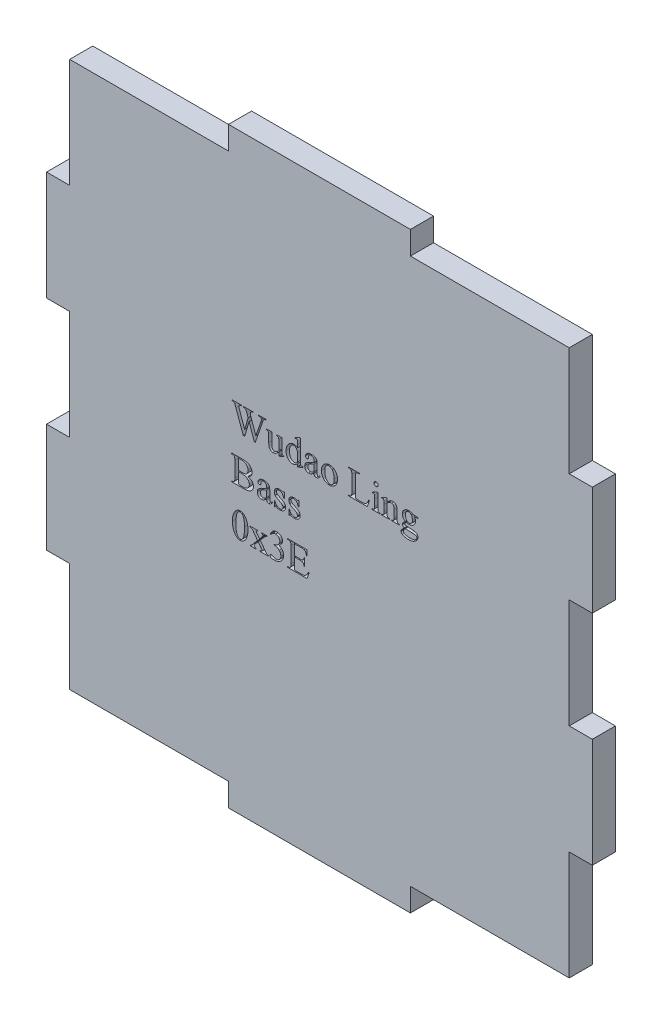
from build123d import *

# Parameters (mm, degrees)
BOSS_EXTRUDE1_DEPTH = 6.35
CUT_EXTRUDE4_DEPTH  = 6.35


with BuildPart() as part:
    # Sketch1 → Boss-Extrude1 (new body)
    with BuildSketch(Plane.XY):
        Polygon((105.283018868, -33.117921942), (105.283018868, -63.117921942), (98.933018868, -63.117921942), (98.933018868, -93.117921942), (55.283018868, -93.117921942), (55.283018868, -99.467921942), (5.283018868, -99.467921942), (5.283018868, -93.117921942), (-38.366981132, -93.117921942), (-38.366981132, -63.117921942), (-44.716981132, -63.117921942), (-44.716981132, -33.117921942), (-38.366981132, -33.117921942), (-38.366981132, -3.117921942), (-44.716981132, -3.117921942), (-44.716981132, 26.882078058), (-38.366981132, 26.882078058), (-38.366981132, 56.882078058), (5.283018868, 56.882078058), (5.283018868, 63.232078058), (55.283018868, 63.232078058), (55.283018868, 56.882078058), (98.933018868, 56.882078058), (98.933018868, 26.882078058), (105.283018868, 26.882078058), (105.283018868, -3.117921942), (98.933018868, -3.117921942), (98.933018868, -33.117921942), align=None)
    extrude(amount=BOSS_EXTRUDE1_DEPTH)

    # Sketch3 → Cut-Extrude4 (cut)
    # profile 1 of 18: a face of its own
    with BuildSketch(Plane.XY):
        with BuildLine():
            Line((15.601268219, -1.828406729), (15.601268219, -2.018652558))
            add(Edge.make_bspline(
                [(15.601268219, -2.018652558), (15.55908621, -2.019680667), (15.478273763, -2.021650324), (15.362964649, -2.039615312), (15.259660264, -2.06866477), (15.166688547, -2.11134689), (15.081967557, -2.171718567), (15.003867919, -2.253079737), (14.923533275, -2.351172242), (14.877886178, -2.42814903), (14.853661564, -2.469000105)],
                knots=[0, 0, 0, 0, 1.091268873, 2.090656883, 3.011953388, 3.861070839, 4.725734505, 5.686955751, 6.772482654, 8, 8, 8, 8], degree=3))
            add(Edge.make_bspline(
                [(14.853661564, -2.469000105), (14.84466342, -2.486298566), (14.824518689, -2.525025752), (14.7927704, -2.591005375), (14.759314033, -2.672644816), (14.722190206, -2.769966205), (14.680867857, -2.881874619), (14.636211109, -3.009358926), (14.587069809, -3.151355043), (14.554262667, -3.251729293), (14.537080615, -3.304298196)],
                knots=[0, 0, 0, 0, 0.523330394, 1.171613704, 1.964313893, 2.890335497, 3.967301935, 5.165867882, 6.515682876, 8, 8, 8, 8], degree=3))
            Line((14.537080615, -3.304298196), (12.649485286, -8.77237947))
            Line((12.649485286, -8.77237947), (12.386410976, -8.77237947))
            Line((12.386410976, -8.77237947), (10.952135784, -4.698443408))
            Line((10.952135784, -4.698443408), (9.748236401, -8.77237947))
            Line((9.748236401, -8.77237947), (9.333559947, -8.77237947))
            Line((9.333559947, -8.77237947), (7.303280245, -3.151209756))
            add(Edge.make_bspline(
                [(7.303280245, -3.151209756), (7.285562904, -3.100633306), (7.251990228, -3.004795747), (7.202837192, -2.870253492), (7.15972595, -2.75166067), (7.120836933, -2.649883964), (7.088852819, -2.56319748), (7.060039742, -2.493775115), (7.038653012, -2.439628872), (7.024000528, -2.409979211), (7.017911503, -2.397657919)],
                knots=[0, 0, 0, 0, 1.595629076, 3.023565284, 4.264980236, 5.352704151, 6.267778839, 7.015613469, 7.590925714, 8, 8, 8, 8], degree=3))
            add(Edge.make_bspline(
                [(7.017911503, -2.397657919), (7.000291473, -2.367491865), (6.965611723, -2.308119024), (6.902258319, -2.228071221), (6.82575965, -2.164489768), (6.743011313, -2.109032557), (6.64682324, -2.066277131), (6.535504707, -2.039957271), (6.410137778, -2.021411127), (6.321414304, -2.019603174), (6.274763735, -2.018652558)],
                knots=[0, 0, 0, 0, 0.948254742, 1.866355333, 2.753481171, 3.637746624, 4.565162299, 5.592907296, 6.734356983, 8, 8, 8, 8], degree=3))
            Line((6.274763735, -2.018652558), (6.274763735, -1.828406729))
            Line((6.274763735, -1.828406729), (8.799979849, -1.828406729))
            Line((8.799979849, -1.828406729), (8.799979849, -2.018652558))
            Line((8.799979849, -2.018652558), (8.679589911, -2.018652558))
            add(Edge.make_bspline(
                [(8.679589911, -2.018652558), (8.637844226, -2.019798486), (8.558539251, -2.021975426), (8.447232826, -2.045678467), (8.350880976, -2.085408903), (8.273160091, -2.143147434), (8.21157164, -2.209953201), (8.167247733, -2.284903945), (8.138814043, -2.36692969), (8.135705562, -2.424673302), (8.13411945, -2.45413715)],
                knots=[0, 0, 0, 0, 1.277771794, 2.427404448, 3.468192999, 4.446162641, 5.370560024, 6.235154597, 7.099482444, 8, 8, 8, 8], degree=3))
            add(Edge.make_bspline(
                [(8.13411945, -2.45413715), (8.134788896, -2.472000952), (8.136340621, -2.513407883), (8.147686636, -2.582422501), (8.166473887, -2.66636347), (8.18965746, -2.765766068), (8.221718705, -2.879881731), (8.258454526, -3.009466145), (8.303298759, -3.153593731), (8.336587938, -3.254313131), (8.354091189, -3.307270787)],
                knots=[0, 0, 0, 0, 0.485453701, 1.125244675, 1.896348863, 2.823806857, 3.898404432, 5.117181068, 6.484231102, 8, 8, 8, 8], degree=3))
            Line((8.354091189, -3.307270787), (9.733373446, -7.158262519))
            Line((9.733373446, -7.158262519), (10.675684815, -3.91219307))
            Line((10.675684815, -3.91219307), (10.451254189, -3.279031172))
            Line((10.451254189, -3.279031172), (10.290734271, -2.806389192))
            add(Edge.make_bspline(
                [(10.290734271, -2.806389192), (10.255685278, -2.724040669), (10.188403381, -2.5659601), (10.097812755, -2.420014824), (10.054413281, -2.350096462)],
                knots=[0, 0, 0, 0, 1.04185509, 2, 2, 2, 2], degree=3))
            add(Edge.make_bspline(
                [(10.054413281, -2.350096462), (10.03146905, -2.318577741), (9.985846348, -2.255905377), (9.924425095, -2.208621752), (9.893893363, -2.185117658)],
                knots=[0, 0, 0, 0, 1.0058252, 2, 2, 2, 2], degree=3))
            add(Edge.make_bspline(
                [(9.893893363, -2.185117658), (9.853230592, -2.156590062), (9.775191996, -2.101840879), (9.686617571, -2.066696718), (9.644195713, -2.049864764)],
                knots=[0, 0, 0, 0, 1.042119488, 2, 2, 2, 2], degree=3))
            add(Edge.make_bspline(
                [(9.644195713, -2.049864764), (9.62593272, -2.045088037), (9.585353698, -2.034474502), (9.516173039, -2.024649458), (9.433735787, -2.019049923), (9.374196243, -2.01879067), (9.34247772, -2.018652558)],
                knots=[0, 0, 0, 0, 0.743877077, 1.65283991, 2.749596568, 4, 4, 4, 4], degree=3))
            Line((9.34247772, -2.018652558), (9.34247772, -1.828406729))
            Line((9.34247772, -1.828406729), (11.991056364, -1.828406729))
            Line((11.991056364, -1.828406729), (11.991056364, -2.018652558))
            Line((11.991056364, -2.018652558), (11.811214604, -2.018652558))
            add(Edge.make_bspline(
                [(11.811214604, -2.018652558), (11.767475867, -2.019722222), (11.685196896, -2.021734416), (11.571205879, -2.04565775), (11.474332084, -2.083193793), (11.398231567, -2.139865166), (11.340208244, -2.209077443), (11.297645502, -2.288825187), (11.273969337, -2.380993961), (11.270521968, -2.445582193), (11.268716733, -2.479404174)],
                knots=[0, 0, 0, 0, 1.292962592, 2.432252016, 3.43201317, 4.34444991, 5.20843361, 6.087723355, 6.998625893, 8, 8, 8, 8], degree=3))
            add(Edge.make_bspline(
                [(11.268716733, -2.479404174), (11.269161644, -2.503234157), (11.270139601, -2.555614828), (11.284581902, -2.639536068), (11.299087296, -2.736787851), (11.326550572, -2.845207107), (11.356173162, -2.967298325), (11.398286019, -3.100110041), (11.441260223, -3.246748276), (11.476326986, -3.347055526), (11.494633655, -3.39942111)],
                knots=[0, 0, 0, 0, 0.600969125, 1.320989814, 2.145657769, 3.083274019, 4.142143315, 5.317555035, 6.599624671, 8, 8, 8, 8], degree=3))
            Line((11.494633655, -3.39942111), (12.798114839, -7.097324402))
            Line((12.798114839, -7.097324402), (14.117945275, -3.304298196))
            add(Edge.make_bspline(
                [(14.117945275, -3.304298196), (14.135547788, -3.254845406), (14.169385606, -3.159780883), (14.213623658, -3.022375178), (14.2506713, -2.896836532), (14.282958705, -2.783744444), (14.305933956, -2.681795726), (14.324777603, -2.591865921), (14.335931803, -2.513876957), (14.33729929, -2.465559239), (14.337917014, -2.443733081)],
                knots=[0, 0, 0, 0, 1.413392629, 2.717005363, 3.886177696, 4.938042881, 5.882955606, 6.699232621, 7.412415255, 8, 8, 8, 8], degree=3))
            add(Edge.make_bspline(
                [(14.337917014, -2.443733081), (14.334657073, -2.405765035), (14.328036741, -2.328659028), (14.267546, -2.226824242), (14.189159281, -2.137555647), (14.117520593, -2.104682244), (14.082274182, -2.088508448)],
                knots=[0, 0, 0, 0, 0.975037365, 1.980118744, 3.006213419, 4, 4, 4, 4], degree=3))
            add(Edge.make_bspline(
                [(14.082274182, -2.088508448), (14.048318992, -2.077196785), (13.977055902, -2.053456553), (13.858852354, -2.034767316), (13.727397907, -2.020720772), (13.634453318, -2.019362707), (13.585851473, -2.018652558)],
                knots=[0, 0, 0, 0, 0.851354763, 1.786771676, 2.842676246, 4, 4, 4, 4], degree=3))
            Line((13.585851473, -2.018652558), (13.585851473, -1.828406729))
            Line((13.585851473, -1.828406729), (15.601268219, -1.828406729))
        make_face()
    # profile 2 of 18: a face of its own
    with BuildSketch(Plane.XY):
        with BuildLine():
            Line((19.959086728, -4.016233757), (19.959086728, -6.869921185))
            add(Edge.make_bspline(
                [(19.959086728, -6.869921185), (19.958966946, -6.929868767), (19.958740245, -7.043325575), (19.960245351, -7.204349409), (19.962941386, -7.346556344), (19.967653159, -7.470899458), (19.972370766, -7.576893182), (19.975428805, -7.665282945), (19.983375769, -7.734566318), (19.992246011, -7.801017018), (20.009127322, -7.865833316), (20.032378626, -7.931810955), (20.059875548, -7.986277286), (20.102930036, -8.039535674), (20.170520349, -8.085191168), (20.231856753, -8.092492288), (20.262291017, -8.096115001)],
                knots=[0, 0, 0, 0, 1.841064281, 3.484398708, 4.94539476, 6.209098227, 7.305558102, 8.204426879, 8.923586287, 9.446474114, 10.262025621, 10.974392726, 11.593755125, 12.123679605, 13.068996096, 14, 14, 14, 14], degree=3))
            add(Edge.make_bspline(
                [(20.262291017, -8.096115001), (20.285131294, -8.094606486), (20.333194436, -8.091432094), (20.407428466, -8.076613402), (20.485325019, -8.048873604), (20.536977435, -8.024271386), (20.564009011, -8.011396156)],
                knots=[0, 0, 0, 0, 0.868715379, 1.82805103, 2.863340615, 4, 4, 4, 4], degree=3))
            Line((20.564009011, -8.011396156), (20.624947128, -8.201641984))
            Line((20.624947128, -8.201641984), (19.317007057, -8.77237947))
            Line((19.317007057, -8.77237947), (19.1029805, -8.77237947))
            Line((19.1029805, -8.77237947), (19.1029805, -7.838985874))
            add(Edge.make_bspline(
                [(19.1029805, -7.838985874), (19.054544338, -7.888146009), (18.961849623, -7.982226229), (18.82671524, -8.11574201), (18.698526979, -8.232274959), (18.581008933, -8.33735954), (18.472275258, -8.428245979), (18.370479628, -8.502124865), (18.279663607, -8.564629497), (18.169897574, -8.627308521), (18.034951626, -8.686164674), (17.870162772, -8.735227268), (17.701073983, -8.766196379), (17.586594031, -8.770309804), (17.528993528, -8.77237947)],
                knots=[0, 0, 0, 0, 1.316344891, 2.519155314, 3.622655191, 4.620068034, 5.526292874, 6.323873919, 7.018402558, 7.627882663, 8.732231869, 9.817454402, 10.9018538, 12, 12, 12, 12], degree=3))
            add(Edge.make_bspline(
                [(17.528993528, -8.77237947), (17.465858553, -8.769401179), (17.342619913, -8.763587594), (17.163992799, -8.72158377), (16.999939484, -8.648280835), (16.849421507, -8.550409361), (16.717895666, -8.428392772), (16.606720313, -8.288990843), (16.518008867, -8.133407739), (16.449685511, -7.95874144), (16.401007236, -7.756779619), (16.368928588, -7.521794061), (16.348256096, -7.250281525), (16.345748632, -7.057237492), (16.344415986, -6.95464003)],
                knots=[0, 0, 0, 0, 0.923765743, 1.803178544, 2.666814356, 3.541701255, 4.419228604, 5.281035968, 6.141774944, 7.030495848, 8.017125976, 9.174907049, 10.49854274, 12, 12, 12, 12], degree=3))
            Line((16.344415986, -6.95464003), (16.344415986, -4.872339986))
            add(Edge.make_bspline(
                [(16.344415986, -4.872339986), (16.343420907, -4.824760253), (16.341604155, -4.737892141), (16.332369252, -4.618923046), (16.314674421, -4.52361731), (16.279509948, -4.429515855), (16.213375462, -4.338282846), (16.122852891, -4.269971528), (16.028427836, -4.233355966), (15.932491856, -4.215455056), (15.813523908, -4.205764692), (15.726138754, -4.20622755), (15.678555587, -4.206479586)],
                knots=[0, 0, 0, 0, 1.269657982, 2.318062497, 3.181365155, 3.846670718, 4.983825075, 6.136547161, 6.818967821, 7.669319949, 8.730892666, 10, 10, 10, 10], degree=3))
            Line((15.678555587, -4.206479586), (15.678555587, -4.016233757))
            Line((15.678555587, -4.016233757), (17.200522215, -4.016233757))
            Line((17.200522215, -4.016233757), (17.200522215, -7.141913268))
            add(Edge.make_bspline(
                [(17.200522215, -7.141913268), (17.200926244, -7.193953142), (17.201700584, -7.293689995), (17.212065394, -7.436147057), (17.229161111, -7.564425827), (17.254850367, -7.678582188), (17.285368454, -7.779243682), (17.321501998, -7.867342242), (17.36832947, -7.939516234), (17.437760817, -8.016652143), (17.537926183, -8.090151148), (17.668824601, -8.156109168), (17.812839999, -8.193556051), (17.912253804, -8.198909655), (17.962991824, -8.201641984)],
                knots=[0, 0, 0, 0, 1.251799049, 2.399131457, 3.43415975, 4.362446073, 5.210759369, 5.963592229, 6.644687934, 7.269309271, 8.451768472, 9.608535475, 10.779463514, 12, 12, 12, 12], degree=3))
            add(Edge.make_bspline(
                [(17.962991824, -8.201641984), (18.000252761, -8.199604667), (18.078501295, -8.195326271), (18.198618047, -8.169308431), (18.324659945, -8.123960008), (18.460868108, -8.065101236), (18.605805894, -7.977390618), (18.761512218, -7.85984037), (18.930994382, -7.712446125), (19.043311061, -7.599015442), (19.1029805, -7.538754176)],
                knots=[0, 0, 0, 0, 0.66150638, 1.389173489, 2.170474756, 3.036385896, 4.017983751, 5.167988868, 6.495463741, 8, 8, 8, 8], degree=3))
            Line((19.1029805, -7.538754176), (19.1029805, -4.872339986))
            add(Edge.make_bspline(
                [(19.1029805, -4.872339986), (19.102168533, -4.813259917), (19.100678499, -4.70484259), (19.075528926, -4.55766658), (19.037617512, -4.439839645), (18.978469086, -4.34725957), (18.886653502, -4.28433161), (18.766221456, -4.241838704), (18.612580527, -4.215181897), (18.499166445, -4.209556899), (18.4371201, -4.206479586)],
                knots=[0, 0, 0, 0, 1.271418358, 2.333168933, 3.204193482, 3.926615942, 4.652578745, 5.554644127, 6.662199676, 8, 8, 8, 8], degree=3))
            Line((18.4371201, -4.206479586), (18.4371201, -4.016233757))
            Line((18.4371201, -4.016233757), (19.959086728, -4.016233757))
        make_face()
    # profile 3 of 18: a face of its own
    with BuildSketch(Plane.XY):
        with BuildLine():
            add(Edge.make_bspline(
                [(24.23961787, -8.048553544), (24.1866931, -8.112424775), (24.085914119, -8.234047933), (23.925396573, -8.392819585), (23.765254831, -8.519364976), (23.605789328, -8.617142653), (23.442828179, -8.686106068), (23.276397578, -8.735706843), (23.103217201, -8.76620902), (22.985305904, -8.770308338), (22.925732616, -8.77237947)],
                knots=[0, 0, 0, 0, 1.276681338, 2.431047791, 3.468744646, 4.413295535, 5.301751392, 6.185116711, 7.083051697, 8, 8, 8, 8], degree=3))
            add(Edge.make_bspline(
                [(22.925732616, -8.77237947), (22.865682285, -8.770171671), (22.746904296, -8.765804703), (22.571134325, -8.737161986), (22.401510802, -8.688114133), (22.237933221, -8.618336618), (22.079410054, -8.53116897), (21.929441364, -8.420345235), (21.782409721, -8.293996974), (21.644550312, -8.147671719), (21.516871494, -7.986605761), (21.405131268, -7.812436229), (21.311101001, -7.626501505), (21.233500346, -7.430085143), (21.174544566, -7.222295975), (21.131020464, -7.004206003), (21.105830307, -6.77439918), (21.102344202, -6.617312149), (21.100561699, -6.536990985)],
                knots=[0, 0, 0, 0, 0.898536616, 1.777281974, 2.657121174, 3.534207546, 4.433569532, 5.357438989, 6.319170923, 7.331246359, 8.360552599, 9.390846183, 10.421966273, 11.473746964, 12.546046459, 13.649566845, 14.79818516, 16, 16, 16, 16], degree=3))
            add(Edge.make_bspline(
                [(21.100561699, -6.536990985), (21.102123711, -6.455654803), (21.105219319, -6.294462135), (21.134648517, -6.055358428), (21.181749363, -5.821595323), (21.249331199, -5.593685415), (21.33428017, -5.370827124), (21.438853605, -5.153185036), (21.562686488, -4.940902235), (21.702168539, -4.735538722), (21.856804657, -4.545417639), (22.026433222, -4.37926019), (22.204675658, -4.236481966), (22.395594168, -4.120748396), (22.597476373, -4.031227328), (22.809984007, -3.966673988), (23.033410705, -3.929275741), (23.185696375, -3.923862866), (23.263121703, -3.921110843)],
                knots=[0, 0, 0, 0, 1.037656121, 2.056434824, 3.069546824, 4.07793207, 5.086634443, 6.110404359, 7.155852558, 8.220400049, 9.276104048, 10.277646771, 11.245387343, 12.18446653, 13.118572775, 14.056693576, 15.01198099, 16, 16, 16, 16], degree=3))
            add(Edge.make_bspline(
                [(23.263121703, -3.921110843), (23.311239086, -3.92212048), (23.405898611, -3.924106702), (23.544957776, -3.943750425), (23.676885734, -3.97710594), (23.803907839, -4.0192941), (23.922630642, -4.078609287), (24.036475552, -4.148044538), (24.14258076, -4.232113552), (24.207010748, -4.296015787), (24.23961787, -4.32835582)],
                knots=[0, 0, 0, 0, 1.059604165, 2.084519579, 3.0851457, 4.055061528, 5.026450086, 6.001755057, 6.988716021, 8, 8, 8, 8], degree=3))
            Line((24.23961787, -4.32835582), (24.23961787, -3.445496272))
            add(Edge.make_bspline(
                [(24.23961787, -3.445496272), (24.239706969, -3.386045156), (24.239876263, -3.273085743), (24.238745468, -3.112544254), (24.234858068, -2.969898661), (24.233738461, -2.845419148), (24.225748709, -2.739568717), (24.223430866, -2.651606187), (24.215128485, -2.581876459), (24.206685137, -2.514352762), (24.18885957, -2.448550184), (24.168822306, -2.381034692), (24.140183425, -2.327629947), (24.097000723, -2.275594941), (24.025958669, -2.232631915), (23.962800898, -2.226764871), (23.930468398, -2.223761342)],
                knots=[0, 0, 0, 0, 1.818975374, 3.456123387, 4.911619446, 6.185263065, 7.263196767, 8.158681708, 8.875133804, 9.411054564, 10.238249601, 10.95726275, 11.560929374, 12.077196615, 13.015654922, 14, 14, 14, 14], degree=3))
            add(Edge.make_bspline(
                [(23.930468398, -2.223761342), (23.910081612, -2.224661394), (23.865865192, -2.226613495), (23.79528301, -2.243331154), (23.715207294, -2.268376001), (23.659780798, -2.291627504), (23.6302367, -2.304021301)],
                knots=[0, 0, 0, 0, 0.781565028, 1.695117994, 2.771424047, 4, 4, 4, 4], degree=3))
            Line((23.6302367, -2.304021301), (23.57375747, -2.113775472))
            Line((23.57375747, -2.113775472), (24.880211245, -1.543037987))
            Line((24.880211245, -1.543037987), (25.095724098, -1.543037987))
            Line((25.095724098, -1.543037987), (25.095724098, -6.869921185))
            add(Edge.make_bspline(
                [(25.095724098, -6.869921185), (25.095607911, -6.929868706), (25.095387055, -7.043820812), (25.096859237, -7.205340792), (25.099623741, -7.348536433), (25.104207114, -7.472884324), (25.109045875, -7.578874087), (25.112066456, -7.666767789), (25.120001892, -7.736056853), (25.12892185, -7.802489495), (25.145421802, -7.866948751), (25.169358111, -7.932186924), (25.196499846, -7.986262225), (25.239778897, -8.039962769), (25.308397275, -8.084853867), (25.370036785, -8.09239734), (25.400414683, -8.096115001)],
                knots=[0, 0, 0, 0, 1.8392632, 3.496189857, 4.955756643, 6.233414571, 7.313614639, 8.211604069, 8.930059936, 9.45243623, 10.267189898, 10.964594102, 11.58335059, 12.112756654, 13.069906881, 14, 14, 14, 14], degree=3))
            add(Edge.make_bspline(
                [(25.400414683, -8.096115001), (25.421773286, -8.094583865), (25.467865657, -8.091279636), (25.541795701, -8.075621237), (25.624946847, -8.048038064), (25.682962725, -8.024172962), (25.71402304, -8.011396156)],
                knots=[0, 0, 0, 0, 0.785920671, 1.696035392, 2.766512398, 4, 4, 4, 4], degree=3))
            Line((25.71402304, -8.011396156), (25.761584498, -8.201641984))
            Line((25.761584498, -8.201641984), (24.459589609, -8.77237947))
            Line((24.459589609, -8.77237947), (24.23961787, -8.77237947))
            Line((24.23961787, -8.77237947), (24.23961787, -8.048553544))
        make_face()
        with BuildLine():
            Line((24.23961787, -7.699274094), (24.23961787, -5.437132289))
            add(Edge.make_bspline(
                [(24.23961787, -5.437132289), (24.233923986, -5.374537837), (24.222909837, -5.253456207), (24.186428461, -5.079260396), (24.136537533, -4.918751121), (24.072144446, -4.771746025), (23.995813041, -4.63927617), (23.905922151, -4.524168174), (23.805640483, -4.42478847), (23.692442251, -4.348454529), (23.577251557, -4.285124808), (23.4611935, -4.240729051), (23.346285069, -4.211696046), (23.269726144, -4.208204334), (23.231909497, -4.206479586)],
                knots=[0, 0, 0, 0, 1.290692949, 2.496694215, 3.649435874, 4.738986981, 5.788414492, 6.782243432, 7.732622262, 8.67594027, 9.57785914, 10.428683843, 11.223840856, 12, 12, 12, 12], degree=3))
            add(Edge.make_bspline(
                [(23.231909497, -4.206479586), (23.197111732, -4.207388976), (23.128441632, -4.20918357), (23.027602308, -4.230645046), (22.928751858, -4.259306366), (22.832861468, -4.303139294), (22.741162269, -4.360489975), (22.650732944, -4.427587567), (22.56456865, -4.508354625), (22.511525135, -4.569148218), (22.484302842, -4.600347903)],
                knots=[0, 0, 0, 0, 0.953767905, 1.88217085, 2.820289327, 3.776092198, 4.765288515, 5.785518375, 6.863512984, 8, 8, 8, 8], degree=3))
            add(Edge.make_bspline(
                [(22.484302842, -4.600347903), (22.44956993, -4.64570506), (22.379312384, -4.73745327), (22.291403546, -4.891336494), (22.217711468, -5.059492306), (22.156277049, -5.242489895), (22.109477493, -5.440558481), (22.075132411, -5.6536057), (22.056593629, -5.881702001), (22.05342356, -6.038555708), (22.051790842, -6.11934194)],
                knots=[0, 0, 0, 0, 0.850578966, 1.720546476, 2.632841675, 3.583065273, 4.593019754, 5.662350692, 6.79601265, 8, 8, 8, 8], degree=3))
            add(Edge.make_bspline(
                [(22.051790842, -6.11934194), (22.052577614, -6.201142035), (22.054106267, -6.360074791), (22.076056116, -6.590805212), (22.108042352, -6.806318937), (22.152172964, -7.007984003), (22.211517526, -7.194279104), (22.282686563, -7.366851378), (22.367506352, -7.524047701), (22.466009275, -7.665101402), (22.572306612, -7.78971251), (22.681169719, -7.900298555), (22.794433932, -7.991959967), (22.909231466, -8.069927899), (23.028851752, -8.127467824), (23.150838663, -8.170149908), (23.275906802, -8.196085594), (23.360605775, -8.199793408), (23.402833483, -8.201641984)],
                knots=[0, 0, 0, 0, 1.429525865, 2.777484388, 4.047738485, 5.237076441, 6.382065964, 7.461390971, 8.496183633, 9.498084563, 10.462910316, 11.357076728, 12.206585818, 13.006521391, 13.777372499, 14.519667258, 15.261962018, 16, 16, 16, 16], degree=3))
            add(Edge.make_bspline(
                [(23.402833483, -8.201641984), (23.438635428, -8.200293336), (23.511024548, -8.197566459), (23.61910779, -8.172268678), (23.725974829, -8.132202848), (23.831146958, -8.07569845), (23.935913233, -8.005290364), (24.039894128, -7.918602002), (24.142422417, -7.815722172), (24.206514935, -7.738934109), (24.23961787, -7.699274094)],
                knots=[0, 0, 0, 0, 0.850298914, 1.71924713, 2.62518494, 3.557995772, 4.551337554, 5.622337873, 6.771969053, 8, 8, 8, 8], degree=3))
        make_face(mode=Mode.SUBTRACT)
    # profile 4 of 18: a face of its own
    with BuildSketch(Plane.XY):
        with BuildLine():
            add(Edge.make_bspline(
                [(28.805517754, -8.015855043), (28.749175325, -8.059139492), (28.642307153, -8.141239787), (28.488713423, -8.254845538), (28.353824736, -8.357268478), (28.233710436, -8.442509752), (28.130588653, -8.515015609), (28.043662284, -8.572147005), (27.974072848, -8.616752573), (27.93171408, -8.63836154), (27.913740433, -8.647530645)],
                knots=[0, 0, 0, 0, 1.558875, 2.95681467, 4.191698034, 5.274657479, 6.188356203, 6.95716577, 7.557505181, 8, 8, 8, 8], degree=3))
            add(Edge.make_bspline(
                [(27.913740433, -8.647530645), (27.868078961, -8.667045703), (27.777044077, -8.705952707), (27.633321495, -8.743074804), (27.486121703, -8.768796564), (27.386221917, -8.771174053), (27.335571469, -8.77237947)],
                knots=[0, 0, 0, 0, 0.998482016, 1.990665029, 2.981241918, 4, 4, 4, 4], degree=3))
            add(Edge.make_bspline(
                [(27.335571469, -8.77237947), (27.296393979, -8.771018688), (27.219741519, -8.76835626), (27.106983215, -8.753866413), (26.999896554, -8.726972079), (26.898612949, -8.689375689), (26.801773986, -8.643325856), (26.711177326, -8.584498192), (26.624637424, -8.516264419), (26.544670015, -8.437331342), (26.47208456, -8.350440854), (26.409713255, -8.255803415), (26.354694509, -8.155539489), (26.313177394, -8.047061776), (26.277632587, -7.933162415), (26.25505067, -7.812429256), (26.23910631, -7.685333467), (26.237845497, -7.598260228), (26.237199069, -7.553617131)],
                knots=[0, 0, 0, 0, 1.021269733, 1.99815853, 2.956354521, 3.891750869, 4.809880197, 5.744652621, 6.700410006, 7.677298803, 8.667491899, 9.645063, 10.627057522, 11.641202316, 12.666381854, 13.732374063, 14.837371315, 16, 16, 16, 16], degree=3))
            add(Edge.make_bspline(
                [(26.237199069, -7.553617131), (26.238439507, -7.497443944), (26.240851637, -7.38821074), (26.273123412, -7.231569385), (26.316516595, -7.084253421), (26.364874566, -6.996548526), (26.388801213, -6.953153735)],
                knots=[0, 0, 0, 0, 1.073591545, 2.087683635, 3.053820535, 4, 4, 4, 4], degree=3))
            add(Edge.make_bspline(
                [(26.388801213, -6.953153735), (26.427704762, -6.894333362), (26.509415532, -6.770790444), (26.674140077, -6.604214542), (26.87374942, -6.441450209), (27.068940729, -6.31326167), (27.248762766, -6.208181811), (27.409449099, -6.126363387), (27.590364762, -6.038309839), (27.791263638, -5.944333356), (28.015813205, -5.850141338), (28.259974329, -5.749355455), (28.525024246, -5.642944798), (28.709744585, -5.573964865), (28.805517754, -5.538200385)],
                knots=[0, 0, 0, 0, 0.890335071, 1.870008429, 2.947759746, 4.145438777, 4.819447813, 5.581919563, 6.425634938, 7.365025325, 8.387143385, 9.505655779, 10.706740942, 12, 12, 12, 12], degree=3))
            Line((28.805517754, -5.538200385), (28.805517754, -5.364303808))
            add(Edge.make_bspline(
                [(28.805517754, -5.364303808), (28.805069057, -5.311280869), (28.804204247, -5.209085431), (28.794256938, -5.062092719), (28.775501165, -4.928427334), (28.755203679, -4.806992584), (28.723268684, -4.699888644), (28.686593825, -4.604793577), (28.642247518, -4.522738858), (28.574819364, -4.431152911), (28.47135739, -4.338976498), (28.322643826, -4.259960239), (28.148842651, -4.213402216), (28.025015009, -4.208867347), (27.959815594, -4.206479586)],
                knots=[0, 0, 0, 0, 1.156239016, 2.228513829, 3.209486664, 4.099496727, 4.909803097, 5.642093741, 6.318967722, 6.93697649, 8.115067704, 9.304155298, 10.580547167, 12, 12, 12, 12], degree=3))
            add(Edge.make_bspline(
                [(27.959815594, -4.206479586), (27.910026784, -4.208072717), (27.814703618, -4.211122847), (27.680184192, -4.245496083), (27.559643977, -4.297222198), (27.494073292, -4.351014793), (27.46190659, -4.377403572)],
                knots=[0, 0, 0, 0, 1.106638015, 2.118713769, 3.077106298, 4, 4, 4, 4], degree=3))
            add(Edge.make_bspline(
                [(27.46190659, -4.377403572), (27.432755921, -4.405469245), (27.37705283, -4.459099051), (27.318062699, -4.556287604), (27.279780719, -4.658972391), (27.275361661, -4.730811125), (27.273147057, -4.766813003)],
                knots=[0, 0, 0, 0, 1.084622452, 2.072570699, 3.034071598, 4, 4, 4, 4], degree=3))
            Line((27.273147057, -4.766813003), (27.283551126, -5.058126927))
            add(Edge.make_bspline(
                [(27.283551126, -5.058126927), (27.282327559, -5.094437411), (27.280004783, -5.163367971), (27.257119736, -5.260487973), (27.220820589, -5.345389746), (27.167014527, -5.414864279), (27.103121147, -5.470737208), (27.027700265, -5.51008145), (26.943240534, -5.534737296), (26.883419475, -5.537020991), (26.85252542, -5.538200385)],
                knots=[0, 0, 0, 0, 1.192988088, 2.264727143, 3.264608775, 4.207008523, 5.131898225, 6.036298471, 6.985863792, 8, 8, 8, 8], degree=3))
            add(Edge.make_bspline(
                [(26.85252542, -5.538200385), (26.822543847, -5.537231337), (26.764371017, -5.535351107), (26.682834187, -5.507457476), (26.60733914, -5.469526783), (26.543959955, -5.411675943), (26.490526768, -5.341187569), (26.454089971, -5.256489401), (26.431066125, -5.160907035), (26.428689359, -5.093448072), (26.427444897, -5.058126927)],
                knots=[0, 0, 0, 0, 0.992015986, 1.924794819, 2.838757396, 3.784255213, 4.749783075, 5.760236574, 6.827272098, 8, 8, 8, 8], degree=3))
            add(Edge.make_bspline(
                [(26.427444897, -5.058126927), (26.428937149, -5.02284004), (26.43190551, -4.952647945), (26.453998026, -4.848857003), (26.487693865, -4.747003594), (26.53815296, -4.648332029), (26.601098605, -4.551406933), (26.67705853, -4.455648192), (26.768576838, -4.364010809), (26.872280595, -4.274667611), (26.988883728, -4.192022598), (27.117068949, -4.118787986), (27.257189801, -4.057553247), (27.407976614, -4.00753358), (27.570653333, -3.968885755), (27.743980478, -3.940847593), (27.928794401, -3.924726443), (28.055402786, -3.922336537), (28.120335512, -3.921110843)],
                knots=[0, 0, 0, 0, 0.751350949, 1.494574915, 2.252349993, 3.031299287, 3.848234099, 4.712108084, 5.630260355, 6.603499815, 7.625714709, 8.670571574, 9.743474444, 10.878456939, 12.051105368, 13.302367809, 14.616484898, 16, 16, 16, 16], degree=3))
            add(Edge.make_bspline(
                [(28.120335512, -3.921110843), (28.21858379, -3.923560793), (28.406982552, -3.928258764), (28.675215172, -3.966844685), (28.917518381, -4.029657268), (29.061494817, -4.097782835), (29.131016476, -4.130678513)],
                knots=[0, 0, 0, 0, 1.131049808, 2.168876517, 3.115808485, 4, 4, 4, 4], degree=3))
            add(Edge.make_bspline(
                [(29.131016476, -4.130678513), (29.178799398, -4.159221151), (29.273944812, -4.216055287), (29.395845244, -4.33203104), (29.496826927, -4.4705202), (29.545887069, -4.575126815), (29.570959954, -4.628587518)],
                knots=[0, 0, 0, 0, 0.983173165, 1.957695623, 2.956251224, 4, 4, 4, 4], degree=3))
            add(Edge.make_bspline(
                [(29.570959954, -4.628587518), (29.57815937, -4.649309289), (29.593917511, -4.694665274), (29.613649749, -4.771461638), (29.626599113, -4.863269831), (29.641173166, -4.96860786), (29.648631337, -5.088803294), (29.656609763, -5.223015431), (29.660825017, -5.372205745), (29.661349373, -5.476269779), (29.661623982, -5.530768908)],
                knots=[0, 0, 0, 0, 0.578071798, 1.265288381, 2.085304142, 3.019791722, 4.067310373, 5.257317904, 6.563636446, 8, 8, 8, 8], degree=3))
            Line((29.661623982, -5.530768908), (29.661623982, -7.125564017))
            add(Edge.make_bspline(
                [(29.661623982, -7.125564017), (29.661451041, -7.179071863), (29.661124367, -7.280144819), (29.663291613, -7.423810394), (29.663910319, -7.550668768), (29.667638118, -7.661616554), (29.669685334, -7.756308992), (29.674752611, -7.83503658), (29.678343987, -7.897591545), (29.685788289, -7.956861528), (29.698722264, -8.014018718), (29.715472494, -8.071469997), (29.737743846, -8.116652576), (29.770108152, -8.160681765), (29.824947229, -8.192816065), (29.871819792, -8.198723849), (29.894972381, -8.201641984)],
                knots=[0, 0, 0, 0, 1.895498962, 3.580478337, 5.089959178, 6.389201248, 7.513008224, 8.444695769, 9.183712318, 9.732301295, 10.558500312, 11.257899372, 11.846575001, 12.334540979, 13.177350527, 14, 14, 14, 14], degree=3))
            add(Edge.make_bspline(
                [(29.894972381, -8.201641984), (29.919620433, -8.200170142), (29.96670888, -8.197358284), (30.009725394, -8.178114344), (30.030225275, -8.168943483)],
                knots=[0, 0, 0, 0, 1.04688317, 2, 2, 2, 2], degree=3))
            add(Edge.make_bspline(
                [(30.030225275, -8.168943483), (30.051330611, -8.154460489), (30.103748764, -8.118489879), (30.187203442, -8.042001352), (30.299036236, -7.943012143), (30.378434968, -7.864711661), (30.422607296, -7.821150327)],
                knots=[0, 0, 0, 0, 0.584543641, 1.451798638, 2.582345273, 4, 4, 4, 4], degree=3))
            Line((30.422607296, -7.821150327), (30.422607296, -8.087197228))
            add(Edge.make_bspline(
                [(30.422607296, -8.087197228), (30.376719481, -8.141310838), (30.288452415, -8.24540055), (30.150404996, -8.385617664), (30.013106314, -8.503815244), (29.87812724, -8.601774467), (29.743634327, -8.676636744), (29.61127522, -8.731455367), (29.479622968, -8.766415771), (29.391317971, -8.770417253), (29.348015624, -8.77237947)],
                knots=[0, 0, 0, 0, 1.29495671, 2.490901519, 3.587659578, 4.59909354, 5.530268421, 6.390197302, 7.210596943, 8, 8, 8, 8], degree=3))
            add(Edge.make_bspline(
                [(29.348015624, -8.77237947), (29.308602624, -8.770739923), (29.232725423, -8.767583496), (29.125695122, -8.733067802), (29.031515594, -8.67880253), (28.949378707, -8.601743563), (28.883914958, -8.496313774), (28.840632082, -8.361323699), (28.810181103, -8.198512907), (28.807153906, -8.079941183), (28.805517754, -8.015855043)],
                knots=[0, 0, 0, 0, 0.892412594, 1.718056717, 2.524775051, 3.344648327, 4.249949684, 5.310413251, 6.546320934, 8, 8, 8, 8], degree=3))
        make_face()
        with BuildLine():
            Line((28.805517754, -7.672520774), (28.805517754, -5.823569128))
            add(Edge.make_bspline(
                [(28.805517754, -5.823569128), (28.745095785, -5.849378904), (28.630174472, -5.898468554), (28.465572897, -5.967908175), (28.318806041, -6.033688786), (28.188229255, -6.092549427), (28.07487971, -6.146320685), (27.978220867, -6.193801103), (27.897705547, -6.23501099), (27.850251649, -6.261891013), (27.829021587, -6.273916675)],
                knots=[0, 0, 0, 0, 1.465697383, 2.787725602, 3.985057731, 5.053380534, 5.982790254, 6.783498627, 7.455758124, 8, 8, 8, 8], degree=3))
            add(Edge.make_bspline(
                [(27.829021587, -6.273916675), (27.76674623, -6.311813173), (27.648635951, -6.383686964), (27.492878996, -6.505523773), (27.363093595, -6.628173762), (27.261961979, -6.756104957), (27.184888772, -6.888066521), (27.134016233, -7.026190549), (27.098431652, -7.16935801), (27.09502974, -7.267531579), (27.093305297, -7.317296141)],
                knots=[0, 0, 0, 0, 1.302370349, 2.470051283, 3.52876103, 4.487475757, 5.376328791, 6.248248042, 7.112030167, 8, 8, 8, 8], degree=3))
            add(Edge.make_bspline(
                [(27.093305297, -7.317296141), (27.095631041, -7.378479441), (27.100111065, -7.496335395), (27.141630528, -7.665686474), (27.210094457, -7.818420425), (27.303822095, -7.951745997), (27.413852677, -8.061553191), (27.535654219, -8.142829087), (27.667474548, -8.191632064), (27.758287251, -8.198302359), (27.803754563, -8.201641984)],
                knots=[0, 0, 0, 0, 1.168223595, 2.250321665, 3.310218344, 4.350849945, 5.348877238, 6.265796639, 7.13173418, 8, 8, 8, 8], degree=3))
            add(Edge.make_bspline(
                [(27.803754563, -8.201641984), (27.837062292, -8.199564387), (27.906407195, -8.195238941), (28.013975637, -8.16993629), (28.128092089, -8.127350727), (28.24998378, -8.069194078), (28.378272457, -7.993258994), (28.515311305, -7.902804765), (28.658619438, -7.79372763), (28.755264755, -7.713984884), (28.805517754, -7.672520774)],
                knots=[0, 0, 0, 0, 0.693887409, 1.444636304, 2.289794561, 3.226439617, 4.252586567, 5.391242417, 6.643515343, 8, 8, 8, 8], degree=3))
        make_face(mode=Mode.SUBTRACT)
    # profile 5 of 18: a face of its own
    with BuildSketch(Plane.XY):
        with BuildLine():
            add(Edge.make_bspline(
                [(33.042946325, -3.921110843), (33.128795894, -3.923179989), (33.296881141, -3.927231179), (33.542202146, -3.965303312), (33.77401015, -4.027684599), (33.992711722, -4.114853435), (34.199958798, -4.224677473), (34.391775994, -4.363234739), (34.572151847, -4.524394299), (34.678682901, -4.647647487), (34.732864348, -4.710333772)],
                knots=[0, 0, 0, 0, 1.065475926, 2.086099963, 3.0740863, 4.040596107, 5.003967888, 5.978764027, 6.972004072, 8, 8, 8, 8], degree=3))
            add(Edge.make_bspline(
                [(34.732864348, -4.710333772), (34.775895024, -4.767157642), (34.860856191, -4.879352544), (34.97142289, -5.057765013), (35.065527391, -5.241980884), (35.141505853, -5.433730027), (35.201200639, -5.631041854), (35.242583467, -5.835077584), (35.268570266, -6.044850922), (35.272094675, -6.18714025), (35.273875923, -6.25905372)],
                knots=[0, 0, 0, 0, 1.022008931, 2.017887745, 3.006334525, 3.985540882, 4.972555944, 5.959340715, 6.968644432, 8, 8, 8, 8], degree=3))
            add(Edge.make_bspline(
                [(35.273875923, -6.25905372), (35.26987744, -6.36233239), (35.261825613, -6.570306742), (35.204251364, -6.883161999), (35.109797597, -7.196718046), (35.002635436, -7.455328531), (34.898457261, -7.655462294), (34.813840837, -7.79885932), (34.721968986, -7.93285565), (34.622137632, -8.056175744), (34.516022431, -8.17012134), (34.402652984, -8.274340139), (34.282401647, -8.369969516), (34.112363528, -8.48172266), (33.887801853, -8.599142625), (33.600786146, -8.698479047), (33.299441092, -8.762598455), (33.092817895, -8.769086623), (32.98795339, -8.77237947)],
                knots=[0, 0, 0, 0, 1.308834484, 2.635626516, 4.018558774, 5.454313625, 6.176211117, 6.877377291, 7.56373373, 8.233630339, 8.886803348, 9.535705325, 10.184029623, 10.831988804, 12.112861064, 13.384043246, 14.672361028, 16, 16, 16, 16], degree=3))
            add(Edge.make_bspline(
                [(32.98795339, -8.77237947), (32.903084259, -8.769793781), (32.736407016, -8.764715661), (32.49352207, -8.725319622), (32.263286246, -8.661432971), (32.046977274, -8.570565094), (31.844413907, -8.452813066), (31.654354065, -8.311313572), (31.47910182, -8.141527286), (31.375958777, -8.01306683), (31.32330239, -7.947485448)],
                knots=[0, 0, 0, 0, 1.054286533, 2.07054756, 3.049048718, 4.017581598, 4.977524521, 5.954009108, 6.955484704, 8, 8, 8, 8], degree=3))
            add(Edge.make_bspline(
                [(31.32330239, -7.947485448), (31.281701404, -7.889167904), (31.199466795, -7.773888896), (31.094305677, -7.591534193), (31.003545789, -7.40469595), (30.932230822, -7.21153139), (30.871978669, -7.014035648), (30.833830125, -6.810093416), (30.806409977, -6.601645933), (30.804207947, -6.460787402), (30.803098953, -6.389847727)],
                knots=[0, 0, 0, 0, 1.027995455, 2.03208656, 3.018382236, 4.006625493, 4.985712438, 5.978986255, 6.982169867, 8, 8, 8, 8], degree=3))
            add(Edge.make_bspline(
                [(30.803098953, -6.389847727), (30.80670661, -6.284529428), (30.813962005, -6.072722719), (30.877044714, -5.757037564), (30.975207469, -5.442688562), (31.090151882, -5.187323469), (31.197673224, -4.988486746), (31.286205022, -4.847689277), (31.382329466, -4.71767591), (31.483024604, -4.597015223), (31.590213014, -4.486532376), (31.704064433, -4.38693011), (31.822412007, -4.294929981), (31.990791885, -4.192356587), (32.206896502, -4.082096639), (32.479362637, -3.990301083), (32.758434371, -3.930521116), (32.948017293, -3.924250634), (33.042946325, -3.921110843)],
                knots=[0, 0, 0, 0, 1.363272819, 2.741691909, 4.154573289, 5.6228479, 6.361000545, 7.082187089, 7.775412212, 8.454224844, 9.116915007, 9.76721148, 10.412930582, 11.055868397, 12.318857477, 13.54686811, 14.771653937, 16, 16, 16, 16], degree=3))
        make_face()
        with BuildLine():
            add(Edge.make_bspline(
                [(32.888371589, -4.206479586), (32.843616508, -4.208587932), (32.753636492, -4.212826758), (32.618588603, -4.244647523), (32.483538866, -4.295151578), (32.349295234, -4.366773033), (32.2186356, -4.461570377), (32.103840525, -4.59198915), (32.0015166, -4.751049425), (31.912750538, -4.93984178), (31.839508915, -5.157366629), (31.791219425, -5.405189133), (31.759416931, -5.680551754), (31.756075545, -5.874002192), (31.754328096, -5.975171273)],
                knots=[0, 0, 0, 0, 0.685027346, 1.377246338, 2.114424952, 2.888451615, 3.701944125, 4.572275557, 5.532062909, 6.591086495, 7.759739625, 9.038147969, 10.451035577, 12, 12, 12, 12], degree=3))
            add(Edge.make_bspline(
                [(31.754328096, -5.975171273), (31.755274774, -6.059437251), (31.757131779, -6.224733561), (31.777533685, -6.468288398), (31.808144766, -6.702527854), (31.851104025, -6.92853557), (31.907729581, -7.145349799), (31.976074845, -7.353898151), (32.056218503, -7.553871248), (32.148700008, -7.742444805), (32.25159503, -7.91529385), (32.36245245, -8.068618751), (32.483305869, -8.196961074), (32.611036098, -8.303301325), (32.747401039, -8.386525933), (32.892650469, -8.444490317), (33.045690164, -8.480217665), (33.15026051, -8.48471995), (33.203466243, -8.487010727)],
                knots=[0, 0, 0, 0, 1.268393838, 2.48808387, 3.676981921, 4.823886065, 5.949193386, 7.04838886, 8.126012347, 9.190153483, 10.207134928, 11.151496333, 12.032709656, 12.854055169, 13.647176273, 14.426997578, 15.199651256, 16, 16, 16, 16], degree=3))
            add(Edge.make_bspline(
                [(33.203466243, -8.487010727), (33.243176877, -8.485995399), (33.321601538, -8.483990223), (33.436505369, -8.4642611), (33.545565032, -8.431217415), (33.649621113, -8.386323535), (33.747583534, -8.327889772), (33.840838288, -8.257652014), (33.927229958, -8.173021043), (34.009476493, -8.076332145), (34.085357395, -7.963685058), (34.148038872, -7.831390629), (34.203216067, -7.682310038), (34.247483136, -7.514542662), (34.280581901, -7.328528802), (34.305880417, -7.12465912), (34.320660234, -6.902344103), (34.321966844, -6.7480677), (34.322646781, -6.667784992)],
                knots=[0, 0, 0, 0, 0.7925425, 1.565194785, 2.319575442, 3.064027887, 3.822549968, 4.592346092, 5.390059812, 6.232539397, 7.124410449, 8.093508243, 9.148505951, 10.295746887, 11.55331183, 12.919243719, 14.396828985, 16, 16, 16, 16], degree=3))
            add(Edge.make_bspline(
                [(34.322646781, -6.667784992), (34.320715889, -6.566185641), (34.316952295, -6.368153462), (34.294113066, -6.079495103), (34.251657931, -5.808160258), (34.196541213, -5.552746726), (34.121895914, -5.314171749), (34.031021563, -5.091919805), (33.925335245, -4.885126254), (33.838995756, -4.760021734), (33.796498161, -4.698443408)],
                knots=[0, 0, 0, 0, 1.176782824, 2.293723966, 3.350316679, 4.355440551, 5.317295722, 6.24112299, 7.134254284, 8, 8, 8, 8], degree=3))
            add(Edge.make_bspline(
                [(33.796498161, -4.698443408), (33.766654514, -4.659054708), (33.708641965, -4.582487695), (33.609080621, -4.48261683), (33.505069915, -4.396161944), (33.392704456, -4.32833528), (33.275400554, -4.273308253), (33.151778429, -4.235475101), (33.02218599, -4.210014522), (32.933581848, -4.207673892), (32.888371589, -4.206479586)],
                knots=[0, 0, 0, 0, 1.101841247, 2.141850159, 3.140102416, 4.113043798, 5.063027868, 6.02484522, 6.992177371, 8, 8, 8, 8], degree=3))
        make_face(mode=Mode.SUBTRACT)
    # profile 6 of 18: a face of its own
    with BuildSketch(Plane.XY):
        with BuildLine():
            Line((43.834938206, -6.869921185), (44.025184035, -6.904105982))
            Line((44.025184035, -6.904105982), (43.454446549, -8.677256556))
            Line((43.454446549, -8.677256556), (38.222686265, -8.677256556))
            Line((38.222686265, -8.677256556), (38.222686265, -8.487010727))
            Line((38.222686265, -8.487010727), (38.470897619, -8.487010727))
            add(Edge.make_bspline(
                [(38.470897619, -8.487010727), (38.504631842, -8.486210376), (38.569906456, -8.484661722), (38.664139136, -8.471199311), (38.751333229, -8.448693391), (38.831329634, -8.418496397), (38.903385025, -8.37707811), (38.966677319, -8.326261294), (39.0246765, -8.268086381), (39.055672868, -8.22298353), (39.071361016, -8.200155689)],
                knots=[0, 0, 0, 0, 1.161464265, 2.247395222, 3.269655372, 4.258323134, 5.183235525, 6.118634609, 7.047787219, 8, 8, 8, 8], degree=3))
            add(Edge.make_bspline(
                [(39.071361016, -8.200155689), (39.079770849, -8.184510591), (39.098587321, -8.149505674), (39.117579083, -8.086866958), (39.135516716, -8.011982067), (39.150570592, -7.923639017), (39.159365086, -7.82171454), (39.169482911, -7.706385526), (39.172945449, -7.577912047), (39.173582807, -7.487723162), (39.173915408, -7.44065867)],
                knots=[0, 0, 0, 0, 0.550464559, 1.231629699, 2.022772906, 2.943490705, 4.010570548, 5.198880139, 6.538253567, 8, 8, 8, 8], degree=3))
            Line((39.173915408, -7.44065867), (39.173915408, -3.065004615))
            add(Edge.make_bspline(
                [(39.173915408, -3.065004615), (39.173985204, -3.012967942), (39.17411757, -2.914282317), (39.165596011, -2.773582721), (39.156268038, -2.648014378), (39.141697396, -2.537807309), (39.122704644, -2.442743427), (39.099040642, -2.363421077), (39.074055848, -2.296701739), (39.048790586, -2.262005524), (39.037176218, -2.246055775)],
                knots=[0, 0, 0, 0, 1.484107705, 2.814555366, 4.019988359, 5.075390106, 5.984573864, 6.780592097, 7.4394417, 8, 8, 8, 8], degree=3))
            add(Edge.make_bspline(
                [(39.037176218, -2.246055775), (39.003091661, -2.210888829), (38.934571982, -2.140193239), (38.799442491, -2.068165843), (38.642318546, -2.026633559), (38.530134773, -2.021410516), (38.470897619, -2.018652558)],
                knots=[0, 0, 0, 0, 0.928124107, 1.865794122, 2.873060895, 4, 4, 4, 4], degree=3))
            Line((38.470897619, -2.018652558), (38.222686265, -2.018652558))
            Line((38.222686265, -2.018652558), (38.222686265, -1.828406729))
            Line((38.222686265, -1.828406729), (41.266619521, -1.828406729))
            Line((41.266619521, -1.828406729), (41.266619521, -2.018652558))
            add(Edge.make_bspline(
                [(41.266619521, -2.018652558), (41.182863721, -2.019152939), (41.028533506, -2.020074952), (40.817240108, -2.035113779), (40.64523781, -2.062678297), (40.510109321, -2.105865552), (40.405526338, -2.160423813), (40.320703525, -2.217995017), (40.253381415, -2.283073192), (40.209870771, -2.345024742), (40.183438367, -2.403786367), (40.168156593, -2.460492997), (40.154764462, -2.529525197), (40.145115366, -2.611553494), (40.136388424, -2.706705182), (40.128279434, -2.814684751), (40.126477268, -2.935694443), (40.125604073, -3.020418263), (40.12514455, -3.065004615)],
                knots=[0, 0, 0, 0, 2.135388661, 3.934712435, 5.396921196, 6.567476567, 7.533666755, 8.395801069, 9.173040373, 9.908931797, 10.310428977, 10.810209104, 11.402366068, 12.102810591, 12.914896488, 13.839298742, 14.862919719, 16, 16, 16, 16], degree=3))
            Line((40.12514455, -3.065004615), (40.12514455, -7.571452678))
            add(Edge.make_bspline(
                [(40.12514455, -7.571452678), (40.125346676, -7.638927375), (40.125717498, -7.762716914), (40.143940275, -7.930523987), (40.162340764, -8.066974625), (40.192293016, -8.142032391), (40.205404509, -8.174888665)],
                knots=[0, 0, 0, 0, 1.320237883, 2.422117385, 3.309287413, 4, 4, 4, 4], degree=3))
            add(Edge.make_bspline(
                [(40.205404509, -8.174888665), (40.228636168, -8.208848984), (40.275892558, -8.277928941), (40.360566038, -8.333116018), (40.432745843, -8.353628883), (40.488997218, -8.363673993), (40.561470306, -8.372078568), (40.650218225, -8.37926601), (40.755282516, -8.385022929), (40.876672711, -8.389825367), (41.014944274, -8.390244175), (41.112541829, -8.391319913), (41.164065129, -8.391887813)],
                knots=[0, 0, 0, 0, 1.192840014, 2.426400607, 2.832970907, 3.376643165, 4.08937609, 4.958642829, 5.97093294, 7.155619234, 8.498406181, 10, 10, 10, 10], degree=3))
            Line((41.164065129, -8.391887813), (41.657515247, -8.391887813))
            add(Edge.make_bspline(
                [(41.657515247, -8.391887813), (41.719451139, -8.391775857), (41.838895859, -8.391559948), (42.010833533, -8.385085939), (42.168991586, -8.376779507), (42.31235613, -8.363916678), (42.441179055, -8.345735355), (42.555318052, -8.325352739), (42.655889149, -8.302128672), (42.771058579, -8.264788526), (42.90188196, -8.200578776), (43.050416972, -8.105285364), (43.190593069, -7.984617963), (43.326118368, -7.838295999), (43.457383211, -7.656897044), (43.584936229, -7.433823132), (43.714526509, -7.168177024), (43.793110382, -6.973527338), (43.834938206, -6.869921185)],
                knots=[0, 0, 0, 0, 1.015520045, 1.958452593, 2.820964462, 3.612367469, 4.317791521, 4.953587295, 5.513193728, 6.009017938, 6.935641285, 7.893331651, 8.89609874, 9.959585258, 11.157137459, 12.558834018, 14.168371213, 16, 16, 16, 16], degree=3))
        make_face()
    # profile 7 of 18: a face of its own
    with BuildSketch(Plane.XY):
        with BuildLine():
            add(Edge.make_bspline(
                [(45.835491997, -1.543037987), (45.873894165, -1.544849125), (45.948594867, -1.548372188), (46.055665436, -1.581665091), (46.153897913, -1.633747869), (46.238601525, -1.707693353), (46.312547008, -1.792396965), (46.364629787, -1.890629442), (46.39792269, -1.997700011), (46.401445753, -2.072400713), (46.403256891, -2.110802881)],
                knots=[0, 0, 0, 0, 1.030380414, 2.004317557, 2.988142639, 4, 5.011857361, 5.995682443, 6.969619586, 8, 8, 8, 8], degree=3))
            add(Edge.make_bspline(
                [(46.403256891, -2.110802881), (46.401371525, -2.149176703), (46.397680701, -2.224297925), (46.365119489, -2.332200925), (46.31158312, -2.43087607), (46.239759849, -2.518409999), (46.153340766, -2.59192053), (46.056145594, -2.646238544), (45.948528245, -2.679066376), (45.873871544, -2.682663663), (45.835491997, -2.684512958)],
                knots=[0, 0, 0, 0, 1.025297121, 2.007138425, 2.986109891, 4.013377504, 5.020242953, 6.005570572, 6.974702879, 8, 8, 8, 8], degree=3))
            add(Edge.make_bspline(
                [(45.835491997, -2.684512958), (45.797140721, -2.682589568), (45.722063636, -2.678824309), (45.613610302, -2.646734557), (45.515984201, -2.590944038), (45.426704382, -2.519590495), (45.355350839, -2.430310676), (45.29956032, -2.332684576), (45.267470568, -2.224231242), (45.26370531, -2.149154157), (45.26178192, -2.110802881)],
                knots=[0, 0, 0, 0, 1.020263738, 1.997284992, 2.977775445, 4, 5.022224555, 6.002715008, 6.979736262, 8, 8, 8, 8], degree=3))
            add(Edge.make_bspline(
                [(45.26178192, -2.110802881), (45.263557665, -2.072382583), (45.267011881, -1.997646615), (45.300730475, -1.891053623), (45.350754906, -1.792034546), (45.425139098, -1.707257032), (45.511245914, -1.633759231), (45.611297253, -1.581296295), (45.720506713, -1.548580399), (45.796615272, -1.544911886), (45.835491997, -1.543037987)],
                knots=[0, 0, 0, 0, 1.023401674, 1.990742365, 2.96169862, 3.966702697, 4.98185377, 5.970689565, 6.963415644, 8, 8, 8, 8], degree=3))
        make_face()
    # profile 8 of 18: a face of its own
    with BuildSketch(Plane.XY):
        with BuildLine():
            Line((46.308133977, -3.921110843), (46.308133977, -7.630904499))
            add(Edge.make_bspline(
                [(46.308133977, -7.630904499), (46.309167263, -7.69679552), (46.311041157, -7.816290665), (46.319645657, -7.978394373), (46.338161809, -8.104178321), (46.362298905, -8.200387269), (46.399819871, -8.271251944), (46.440906621, -8.329772891), (46.49016722, -8.378316003), (46.547202708, -8.421376118), (46.622700214, -8.453326584), (46.719603801, -8.471605526), (46.838851615, -8.485265353), (46.9263784, -8.486395765), (46.973994377, -8.487010727)],
                knots=[0, 0, 0, 0, 1.827231777, 3.31373418, 4.494792293, 5.351337946, 6.045469825, 6.704897256, 7.326476523, 7.955597673, 8.675216834, 9.575048766, 10.68078758, 12, 12, 12, 12], degree=3))
            Line((46.973994377, -8.487010727), (46.973994377, -8.677256556))
            Line((46.973994377, -8.677256556), (44.786167349, -8.677256556))
            Line((44.786167349, -8.677256556), (44.786167349, -8.487010727))
            add(Edge.make_bspline(
                [(44.786167349, -8.487010727), (44.834731467, -8.486126027), (44.923611729, -8.484506881), (45.044297192, -8.474086103), (45.139285, -8.454068389), (45.21332072, -8.426195935), (45.267627329, -8.38368916), (45.315138486, -8.335039762), (45.356487905, -8.275417696), (45.392591104, -8.201202444), (45.421552787, -8.104294386), (45.438274127, -7.976211441), (45.449791031, -7.814926779), (45.451238527, -7.695836418), (45.452027748, -7.630904499)],
                knots=[0, 0, 0, 0, 1.345838407, 2.463103905, 3.348975853, 4.032142177, 4.630628879, 5.242195399, 5.912414147, 6.630671645, 7.520787315, 8.701116565, 10.201341998, 12, 12, 12, 12], degree=3))
            Line((45.452027748, -7.630904499), (45.452027748, -5.823569128))
            add(Edge.make_bspline(
                [(45.452027748, -5.823569128), (45.452316561, -5.766096535), (45.452869334, -5.656096536), (45.449126326, -5.499057249), (45.446059988, -5.357865975), (45.444044087, -5.232451804), (45.438042268, -5.122927818), (45.430146077, -5.029367267), (45.423809259, -4.951860415), (45.416581277, -4.906001702), (45.413384065, -4.885716645)],
                knots=[0, 0, 0, 0, 1.468246674, 2.810159154, 4.01286899, 5.07638342, 6.014390898, 6.814308156, 7.475523319, 8, 8, 8, 8], degree=3))
            add(Edge.make_bspline(
                [(45.413384065, -4.885716645), (45.407968714, -4.861782704), (45.397774966, -4.816729928), (45.375791809, -4.756411117), (45.350646408, -4.706230453), (45.309218161, -4.657090344), (45.239670502, -4.611861645), (45.175412735, -4.608220735), (45.141391982, -4.606293085)],
                knots=[0, 0, 0, 0, 1.023772961, 1.927129924, 2.676903813, 3.35248345, 4.598293855, 6, 6, 6, 6], degree=3))
            add(Edge.make_bspline(
                [(45.141391982, -4.606293085), (45.120005335, -4.607123977), (45.074777287, -4.608881133), (45.004335226, -4.625728779), (44.92719039, -4.649036418), (44.874680485, -4.670711643), (44.847105466, -4.682094157)],
                knots=[0, 0, 0, 0, 0.838083998, 1.772363154, 2.830180171, 4, 4, 4, 4], degree=3))
            Line((44.847105466, -4.682094157), (44.786167349, -4.491848328))
            Line((44.786167349, -4.491848328), (46.098566306, -3.921110843))
            Line((46.098566306, -3.921110843), (46.308133977, -3.921110843))
        make_face()
    # profile 9 of 18: a face of its own
    with BuildSketch(Plane.XY):
        with BuildLine():
            add(Edge.make_bspline(
                [(48.876452662, -4.854504439), (48.942868392, -4.780761091), (49.070981431, -4.638513398), (49.271710684, -4.447653112), (49.470638177, -4.286686109), (49.666561928, -4.153921241), (49.860288157, -4.049624341), (50.053021895, -3.97611158), (50.243707422, -3.930474433), (50.370443157, -3.924192155), (50.432604087, -3.921110843)],
                knots=[0, 0, 0, 0, 1.274487827, 2.458431271, 3.553720858, 4.558058417, 5.494704848, 6.372903391, 7.201946956, 8, 8, 8, 8], degree=3))
            add(Edge.make_bspline(
                [(50.432604087, -3.921110843), (50.49425147, -3.923148965), (50.613696867, -3.927097946), (50.785639938, -3.964755991), (50.945308517, -4.021389488), (51.090767715, -4.107238928), (51.223937201, -4.218390961), (51.340402636, -4.361868135), (51.444030906, -4.534348797), (51.496170297, -4.664365574), (51.52354501, -4.732628205)],
                knots=[0, 0, 0, 0, 1.009890193, 1.956721114, 2.874683285, 3.777956534, 4.712428408, 5.70516703, 6.795145204, 8, 8, 8, 8], degree=3))
            add(Edge.make_bspline(
                [(51.52354501, -4.732628205), (51.541338236, -4.789259968), (51.580525163, -4.91398298), (51.610466981, -5.12766699), (51.631402688, -5.380205969), (51.633755832, -5.562410529), (51.635017175, -5.660076619)],
                knots=[0, 0, 0, 0, 0.758265335, 1.669966321, 2.751045093, 4, 4, 4, 4], degree=3))
            Line((51.635017175, -5.660076619), (51.635017175, -7.630904499))
            add(Edge.make_bspline(
                [(51.635017175, -7.630904499), (51.635804497, -7.69782915), (51.63724069, -7.819909848), (51.6486644, -7.985103364), (51.665963016, -8.116657807), (51.691056957, -8.189491257), (51.701900474, -8.220963826)],
                knots=[0, 0, 0, 0, 1.345312921, 2.454054523, 3.331970734, 4, 4, 4, 4], degree=3))
            add(Edge.make_bspline(
                [(51.701900474, -8.220963826), (51.722403702, -8.259740845), (51.763406185, -8.337287366), (51.852221599, -8.412707071), (51.946464369, -8.453438164), (52.044049997, -8.471689086), (52.164239532, -8.485242462), (52.25276201, -8.486388052), (52.300877575, -8.487010727)],
                knots=[0, 0, 0, 0, 1.117480806, 2.234745053, 2.900190891, 3.732282984, 4.767403638, 6, 6, 6, 6], degree=3))
            Line((52.300877575, -8.487010727), (52.300877575, -8.677256556))
            Line((52.300877575, -8.677256556), (50.113050547, -8.677256556))
            Line((50.113050547, -8.677256556), (50.113050547, -8.487010727))
            Line((50.113050547, -8.487010727), (50.199255688, -8.487010727))
            add(Edge.make_bspline(
                [(50.199255688, -8.487010727), (50.243393702, -8.485985403), (50.325161772, -8.484085934), (50.437788157, -8.467815144), (50.52893171, -8.436731171), (50.602095066, -8.394078678), (50.656622304, -8.335742371), (50.701201577, -8.268184707), (50.73767572, -8.189562149), (50.753046043, -8.132085574), (50.7610754, -8.102060184)],
                knots=[0, 0, 0, 0, 1.402756822, 2.598683266, 3.599601554, 4.447518272, 5.26035404, 6.111917729, 7.013678049, 8, 8, 8, 8], degree=3))
            add(Edge.make_bspline(
                [(50.7610754, -8.102060184), (50.763781681, -8.082761542), (50.771038976, -8.03100936), (50.775373036, -7.933153768), (50.777931644, -7.795412961), (50.778557002, -7.690362068), (50.778910947, -7.630904499)],
                knots=[0, 0, 0, 0, 0.495412805, 1.328523213, 2.48797557, 4, 4, 4, 4], degree=3))
            Line((50.778910947, -7.630904499), (50.778910947, -5.710610667))
            add(Edge.make_bspline(
                [(50.778910947, -5.710610667), (50.778273979, -5.659075686), (50.777042238, -5.559419506), (50.769529511, -5.415654799), (50.758188411, -5.282650828), (50.74080297, -5.160952857), (50.716791538, -5.050365464), (50.688658005, -4.950548306), (50.656942419, -4.860848325), (50.61747848, -4.782344857), (50.573330234, -4.713424533), (50.521410753, -4.653679462), (50.462619519, -4.603800649), (50.396479501, -4.562468178), (50.3241777, -4.529736085), (50.243905494, -4.507766844), (50.157118713, -4.494141021), (50.096755615, -4.492630658), (50.06548909, -4.491848328)],
                knots=[0, 0, 0, 0, 1.539222667, 2.976484047, 4.298769683, 5.525087288, 6.645404249, 7.675929622, 8.621580188, 9.481872754, 10.294522658, 11.060140429, 11.836973001, 12.588300486, 13.383105739, 14.198177052, 15.06670227, 16, 16, 16, 16], degree=3))
            add(Edge.make_bspline(
                [(50.06548909, -4.491848328), (50.015789378, -4.493888362), (49.915429862, -4.498007838), (49.76545996, -4.530894789), (49.616262957, -4.583819421), (49.466123692, -4.655524161), (49.317430878, -4.750476205), (49.169162663, -4.865863811), (49.018981249, -4.999909157), (48.925133182, -5.101855111), (48.876452662, -5.154736137)],
                knots=[0, 0, 0, 0, 0.85022098, 1.716866392, 2.615460505, 3.556252374, 4.55868006, 5.629125781, 6.770188934, 8, 8, 8, 8], degree=3))
            Line((48.876452662, -5.154736137), (48.876452662, -7.630904499))
            add(Edge.make_bspline(
                [(48.876452662, -7.630904499), (48.876862202, -7.701286539), (48.877592311, -7.826760378), (48.885914997, -7.992848768), (48.898754146, -8.115473176), (48.917937155, -8.180473341), (48.925500414, -8.206100871)],
                knots=[0, 0, 0, 0, 1.457443032, 2.5982619, 3.447338551, 4, 4, 4, 4], degree=3))
            add(Edge.make_bspline(
                [(48.925500414, -8.206100871), (48.936177074, -8.229296314), (48.956700959, -8.273885219), (48.998038023, -8.332064089), (49.042445217, -8.382750782), (49.098125822, -8.424671318), (49.172898396, -8.454774151), (49.271919244, -8.474003623), (49.397911963, -8.484560411), (49.491261571, -8.486144444), (49.542313061, -8.487010727)],
                knots=[0, 0, 0, 0, 0.834471018, 1.604114647, 2.327743394, 3.035183176, 3.863955918, 4.942799984, 6.328063495, 8, 8, 8, 8], degree=3))
            Line((49.542313061, -8.487010727), (49.542313061, -8.677256556))
            Line((49.542313061, -8.677256556), (47.354486034, -8.677256556))
            Line((47.354486034, -8.677256556), (47.354486034, -8.487010727))
            Line((47.354486034, -8.487010727), (47.449608948, -8.487010727))
            add(Edge.make_bspline(
                [(47.449608948, -8.487010727), (47.501394655, -8.485738181), (47.596928336, -8.483390602), (47.726764603, -8.448771507), (47.831701131, -8.393992211), (47.911454598, -8.309398221), (47.962539548, -8.191368496), (47.995639397, -8.039270438), (48.017226016, -7.848495555), (48.019244212, -7.707763954), (48.020346433, -7.630904499)],
                knots=[0, 0, 0, 0, 1.030840148, 1.90168213, 2.658604156, 3.365205294, 4.174760124, 5.191798125, 6.466322665, 8, 8, 8, 8], degree=3))
            Line((48.020346433, -7.630904499), (48.020346433, -5.823569128))
            add(Edge.make_bspline(
                [(48.020346433, -5.823569128), (48.02043568, -5.763127145), (48.020604667, -5.648681444), (48.019484971, -5.486653835), (48.015600617, -5.343511391), (48.014418745, -5.218542025), (48.006518527, -5.112185548), (48.00416662, -5.024238306), (47.99604798, -4.955439679), (47.986864308, -4.889705801), (47.972560246, -4.824826376), (47.948475599, -4.760904075), (47.922631079, -4.708615152), (47.880305674, -4.658102677), (47.809144646, -4.613761295), (47.744160041, -4.608880482), (47.709710667, -4.606293085)],
                knots=[0, 0, 0, 0, 1.850123203, 3.503171693, 4.959322247, 6.233538586, 7.32709827, 8.222985885, 8.92468213, 9.445835761, 10.25513813, 10.950910005, 11.53431706, 12.029447266, 12.955378578, 14, 14, 14, 14], degree=3))
            add(Edge.make_bspline(
                [(47.709710667, -4.606293085), (47.688329358, -4.607141361), (47.643112597, -4.60893528), (47.573498935, -4.625252433), (47.49809148, -4.649437873), (47.446980102, -4.670779657), (47.419883037, -4.682094157)],
                knots=[0, 0, 0, 0, 0.849806483, 1.797153629, 2.832145149, 4, 4, 4, 4], degree=3))
            Line((47.419883037, -4.682094157), (47.354486034, -4.491848328))
            Line((47.354486034, -4.491848328), (48.671343878, -3.921110843))
            Line((48.671343878, -3.921110843), (48.876452662, -3.921110843))
            Line((48.876452662, -3.921110843), (48.876452662, -4.854504439))
        make_face()
    # profile 10 of 18: a face of its own
    with BuildSketch(Plane.XY):
        with BuildLine():
            add(Edge.make_bspline(
                [(53.931343777, -6.927886711), (53.864299035, -6.892600923), (53.733321414, -6.823667126), (53.558856709, -6.689819965), (53.407356357, -6.5380376), (53.281886517, -6.365922031), (53.183983028, -6.178738687), (53.114183249, -5.980456367), (53.068468781, -5.773627521), (53.06408027, -5.632079322), (53.061860889, -5.560494818)],
                knots=[0, 0, 0, 0, 1.060434438, 2.071649099, 3.068572376, 4.057626617, 5.045485331, 6.018610623, 6.997961293, 8, 8, 8, 8], degree=3))
            add(Edge.make_bspline(
                [(53.061860889, -5.560494818), (53.062964327, -5.505386004), (53.065143691, -5.396542471), (53.09225688, -5.236901801), (53.131559716, -5.082637059), (53.189020016, -4.935070914), (53.260604286, -4.792023376), (53.350097999, -4.656002557), (53.455141105, -4.525645793), (53.574829924, -4.402905512), (53.708102683, -4.290990722), (53.850478416, -4.190403659), (54.003475067, -4.107272015), (54.164401497, -4.037974919), (54.335293956, -3.986921569), (54.513940766, -3.947435115), (54.702173371, -3.925302792), (54.830497841, -3.922526756), (54.895949579, -3.921110843)],
                knots=[0, 0, 0, 0, 0.963303584, 1.902587948, 2.825729429, 3.745077078, 4.667852096, 5.620090525, 6.588180789, 7.593632418, 8.614882691, 9.6298208, 10.638630785, 11.656342207, 12.690210242, 13.754703964, 14.854789526, 16, 16, 16, 16], degree=3))
            add(Edge.make_bspline(
                [(54.895949579, -3.921110843), (54.950004569, -3.922202792), (55.056434579, -3.924352753), (55.213463386, -3.942899845), (55.364719882, -3.971994374), (55.510323543, -4.014200509), (55.650502985, -4.067934776), (55.785615629, -4.132903025), (55.914791997, -4.210901953), (55.995302624, -4.271179159), (56.035938255, -4.3016025)],
                knots=[0, 0, 0, 0, 1.05856506, 2.084231085, 3.092998655, 4.072826633, 5.049718322, 6.030699153, 7.006046959, 8, 8, 8, 8], degree=3))
            Line((56.035938255, -4.3016025), (57.010948126, -4.3016025))
            add(Edge.make_bspline(
                [(57.010948126, -4.3016025), (57.043159197, -4.301457787), (57.10015297, -4.301201733), (57.173927334, -4.302631526), (57.225718873, -4.304698538), (57.263013174, -4.310106132), (57.292007181, -4.317608094), (57.306498632, -4.330360106), (57.31266612, -4.335787297)],
                knots=[0, 0, 0, 0, 1.876536566, 3.3203149, 4.30358463, 4.887440067, 5.526500184, 6, 6, 6, 6], degree=3))
            add(Edge.make_bspline(
                [(57.31266612, -4.335787297), (57.321284087, -4.348780233), (57.341703517, -4.379565722), (57.34213985, -4.416813968), (57.34239203, -4.438341689)],
                knots=[0, 0, 0, 0, 0.844094811, 2, 2, 2, 2], degree=3))
            add(Edge.make_bspline(
                [(57.34239203, -4.438341689), (57.342569052, -4.462171093), (57.342868776, -4.50251772), (57.32460279, -4.538184906), (57.317125006, -4.552786445)],
                knots=[0, 0, 0, 0, 1.181234018, 2, 2, 2, 2], degree=3))
            add(Edge.make_bspline(
                [(57.317125006, -4.552786445), (57.309832393, -4.557494928), (57.292780613, -4.568504426), (57.263426343, -4.579006746), (57.223635925, -4.583943104), (57.169942715, -4.583346784), (57.093737674, -4.588382786), (57.035236238, -4.587482342), (57.002030353, -4.586971243)],
                knots=[0, 0, 0, 0, 0.485533794, 1.135287894, 1.724084104, 2.723689836, 4.14033999, 6, 6, 6, 6], degree=3))
            Line((57.002030353, -4.586971243), (56.395621774, -4.586971243))
            add(Edge.make_bspline(
                [(56.395621774, -4.586971243), (56.417971116, -4.618812181), (56.463136509, -4.683158972), (56.521088074, -4.786902851), (56.567931315, -4.898075554), (56.609444365, -5.014190328), (56.637744499, -5.138128159), (56.66057543, -5.267504627), (56.674104889, -5.403653236), (56.675709585, -5.496554549), (56.676531631, -5.544145567)],
                knots=[0, 0, 0, 0, 0.919464778, 1.858130217, 2.802552383, 3.769445987, 4.769546081, 5.803710743, 6.87489597, 8, 8, 8, 8], degree=3))
            add(Edge.make_bspline(
                [(56.676531631, -5.544145567), (56.675360244, -5.598753489), (56.673058974, -5.706034472), (56.64718174, -5.863497729), (56.611325691, -6.015897947), (56.557120589, -6.16241912), (56.487143679, -6.302355311), (56.401031791, -6.435661806), (56.30130862, -6.563725942), (56.187343863, -6.685096184), (56.060868943, -6.796554048), (55.92079807, -6.891701947), (55.77255816, -6.97415796), (55.612194572, -7.039889115), (55.441982743, -7.0915414), (55.260889663, -7.12855165), (55.069932127, -7.151281655), (54.939116875, -7.153933023), (54.872168851, -7.155289928)],
                knots=[0, 0, 0, 0, 0.967145534, 1.900023331, 2.822422761, 3.73941193, 4.662480189, 5.59075709, 6.548283035, 7.536262029, 8.538505248, 9.530069537, 10.532466687, 11.540504488, 12.596312323, 13.681521822, 14.813459978, 16, 16, 16, 16], degree=3))
            add(Edge.make_bspline(
                [(54.872168851, -7.155289928), (54.815112342, -7.153888379), (54.700078775, -7.151062668), (54.526873934, -7.126848695), (54.351079795, -7.092505022), (54.235277232, -7.057235356), (54.17658254, -7.039358876)],
                knots=[0, 0, 0, 0, 0.966787165, 1.949172472, 2.960535186, 4, 4, 4, 4], degree=3))
            add(Edge.make_bspline(
                [(54.17658254, -7.039358876), (54.135935581, -7.06994346), (54.059663096, -7.127334278), (53.960762865, -7.216749921), (53.879662145, -7.298013172), (53.821352127, -7.375767118), (53.779721958, -7.447620475), (53.751798478, -7.513204041), (53.731789497, -7.572781604), (53.729011579, -7.61145509), (53.727721289, -7.629418203)],
                knots=[0, 0, 0, 0, 1.596982521, 2.996677469, 4.185369058, 5.196946961, 6.040498987, 6.786374716, 7.436293692, 8, 8, 8, 8], degree=3))
            add(Edge.make_bspline(
                [(53.727721289, -7.629418203), (53.733063681, -7.658481578), (53.744877809, -7.722752117), (53.801807475, -7.792717037), (53.870046546, -7.842763539), (53.946838427, -7.871598034), (54.041473413, -7.899233826), (54.112458119, -7.910245431), (54.151315516, -7.916273242)],
                knots=[0, 0, 0, 0, 0.946213087, 2.092448863, 2.805347031, 3.675952831, 4.727804469, 6, 6, 6, 6], degree=3))
            add(Edge.make_bspline(
                [(54.151315516, -7.916273242), (54.165675638, -7.917842298), (54.199301884, -7.921516463), (54.256330759, -7.925424686), (54.327124275, -7.930573475), (54.411457044, -7.93216592), (54.509952634, -7.938106512), (54.622009943, -7.939493341), (54.747776729, -7.945343418), (54.835994856, -7.946745282), (54.88257292, -7.947485448)],
                knots=[0, 0, 0, 0, 0.473512563, 1.10879633, 1.873693077, 2.800019548, 3.873055237, 5.107824933, 6.472967868, 8, 8, 8, 8], degree=3))
            add(Edge.make_bspline(
                [(54.88257292, -7.947485448), (54.968287902, -7.949274187), (55.131809112, -7.952686621), (55.365133565, -7.960565102), (55.575206083, -7.967810637), (55.761479267, -7.975383402), (55.924066085, -7.981991642), (56.062712161, -7.99166248), (56.177850696, -7.999210682), (56.246521344, -8.007674383), (56.276718132, -8.011396156)],
                knots=[0, 0, 0, 0, 1.473906238, 2.81181802, 4.013528083, 5.08756675, 6.016941004, 6.810707218, 7.477028077, 8, 8, 8, 8], degree=3))
            add(Edge.make_bspline(
                [(56.276718132, -8.011396156), (56.354081893, -8.024367902), (56.503743697, -8.049462015), (56.712412178, -8.125051932), (56.897057057, -8.226952418), (57.054790264, -8.354533839), (57.183624954, -8.503853564), (57.275083918, -8.673272462), (57.333536269, -8.859265683), (57.339387638, -8.98942928), (57.34239203, -9.056261917)],
                knots=[0, 0, 0, 0, 1.146718955, 2.218351632, 3.231597863, 4.221833066, 5.173945504, 6.099145575, 7.024004285, 8, 8, 8, 8], degree=3))
            add(Edge.make_bspline(
                [(57.34239203, -9.056261917), (57.340570107, -9.103440861), (57.336919838, -9.197965073), (57.310585024, -9.338107104), (57.26896275, -9.476504793), (57.208283797, -9.611997322), (57.132608858, -9.746557463), (57.037862962, -9.877170031), (56.927328709, -10.005811957), (56.84416441, -10.086414791), (56.801380456, -10.127880998)],
                knots=[0, 0, 0, 0, 0.915700769, 1.834629755, 2.759731338, 3.715969262, 4.711094397, 5.752211511, 6.84362302, 8, 8, 8, 8], degree=3))
            add(Edge.make_bspline(
                [(56.801380456, -10.127880998), (56.733670506, -10.186809088), (56.598639055, -10.304327202), (56.375514673, -10.454446822), (56.137684562, -10.581169466), (55.88512117, -10.686252392), (55.616335631, -10.765673433), (55.333002049, -10.823831294), (55.034524912, -10.858193144), (54.830642002, -10.862754129), (54.726511888, -10.865083584)],
                knots=[0, 0, 0, 0, 0.954355501, 1.903235931, 2.853637942, 3.817899912, 4.80852959, 5.830976457, 6.892204029, 8, 8, 8, 8], degree=3))
            add(Edge.make_bspline(
                [(54.726511888, -10.865083584), (54.646219543, -10.863428111), (54.48837757, -10.860173717), (54.255912045, -10.841305756), (54.032980856, -10.807133858), (53.820152606, -10.759272823), (53.61602602, -10.700185723), (53.421925627, -10.625655675), (53.236397818, -10.538728813), (53.120748617, -10.468777553), (53.063347184, -10.434057878)],
                knots=[0, 0, 0, 0, 1.106770549, 2.175734789, 3.212005835, 4.212655803, 5.180689856, 6.138189509, 7.075907232, 8, 8, 8, 8], degree=3))
            add(Edge.make_bspline(
                [(53.063347184, -10.434057878), (53.033309903, -10.413677421), (52.975858595, -10.374696399), (52.897816121, -10.311616057), (52.830891157, -10.248684088), (52.776223813, -10.184018826), (52.734247389, -10.118477972), (52.704000603, -10.052530715), (52.684784546, -9.985777732), (52.682504073, -9.940730408), (52.681369232, -9.918313328)],
                knots=[0, 0, 0, 0, 1.302975239, 2.492157331, 3.599473359, 4.597178255, 5.52502496, 6.384885853, 7.19626426, 8, 8, 8, 8], degree=3))
            add(Edge.make_bspline(
                [(52.681369232, -9.918313328), (52.683704962, -9.87819429), (52.688499841, -9.795836346), (52.720136618, -9.719603546), (52.736362167, -9.680506042)],
                knots=[0, 0, 0, 0, 0.974260309, 2, 2, 2, 2], degree=3))
            add(Edge.make_bspline(
                [(52.736362167, -9.680506042), (52.753502079, -9.646408905), (52.7917107, -9.570398914), (52.872358741, -9.454304551), (52.969349028, -9.316478334), (53.045873314, -9.221766348), (53.087127913, -9.170706673)],
                knots=[0, 0, 0, 0, 0.73772341, 1.644547156, 2.730164378, 4, 4, 4, 4], degree=3))
            add(Edge.make_bspline(
                [(53.087127913, -9.170706673), (53.092585535, -9.1647687), (53.108011125, -9.147985428), (53.13730575, -9.115385673), (53.180613308, -9.069494313), (53.237548777, -9.009510026), (53.308477928, -8.935767588), (53.393157607, -8.848038142), (53.491722819, -8.746928603), (53.561313378, -8.674339218), (53.598413577, -8.635640281)],
                knots=[0, 0, 0, 0, 0.261532444, 0.739203326, 1.421196502, 2.30758673, 3.421122405, 4.739106495, 6.261548662, 8, 8, 8, 8], degree=3))
            add(Edge.make_bspline(
                [(53.598413577, -8.635640281), (53.552562406, -8.609856263), (53.467063469, -8.56177666), (53.35132545, -8.487542528), (53.258328507, -8.416571071), (53.182801196, -8.350837837), (53.129185067, -8.281035027), (53.089495803, -8.209865006), (53.066030045, -8.133221601), (53.063259662, -8.080910652), (53.061860889, -8.054498726)],
                knots=[0, 0, 0, 0, 1.518576081, 2.831697328, 3.96450047, 4.895822187, 5.711199234, 6.491972498, 7.238593247, 8, 8, 8, 8], degree=3))
            add(Edge.make_bspline(
                [(53.061860889, -8.054498726), (53.064266298, -8.022130167), (53.069304955, -7.954327142), (53.099715616, -7.849436744), (53.150188563, -7.73871608), (53.205058606, -7.640381148), (53.262415588, -7.555281785), (53.32120683, -7.484714706), (53.391154088, -7.406908068), (53.475270215, -7.323897677), (53.571402311, -7.233690705), (53.680082282, -7.13721488), (53.801058564, -7.034223524), (53.88662172, -6.964388175), (53.931343777, -6.927886711)],
                knots=[0, 0, 0, 0, 0.796565161, 1.668579922, 2.666957267, 3.785336268, 4.434205472, 5.187768824, 6.041807289, 7.006762318, 8.092883616, 9.283842224, 10.580321635, 12, 12, 12, 12], degree=3))
        make_face()
        with BuildLine():
            add(Edge.make_bspline(
                [(54.803799256, -4.206479586), (54.742922753, -4.209657941), (54.624098065, -4.215861765), (54.454327811, -4.272261642), (54.301142131, -4.363856486), (54.188947648, -4.467720595), (54.110147148, -4.567645492), (54.058213562, -4.654014925), (54.015354961, -4.750119402), (53.979556687, -4.855071863), (53.951330598, -4.969393198), (53.932675163, -5.093798898), (53.920636756, -5.227329255), (53.91887493, -5.319687262), (53.917967117, -5.367276399)],
                knots=[0, 0, 0, 0, 1.328701039, 2.593488059, 3.866791636, 5.209083291, 5.911594118, 6.645830179, 7.407397403, 8.209460253, 9.069071331, 9.979650076, 10.958978093, 12, 12, 12, 12], degree=3))
            add(Edge.make_bspline(
                [(53.917967117, -5.367276399), (53.919142696, -5.42924343), (53.921422902, -5.549437576), (53.938030376, -5.7242329), (53.964558166, -5.888159619), (54.001114395, -6.042104175), (54.050419128, -6.18526594), (54.110146731, -6.318001944), (54.17889139, -6.441478712), (54.236049205, -6.514372421), (54.264273977, -6.550367645)],
                knots=[0, 0, 0, 0, 1.182864539, 2.294339271, 3.348564671, 4.351031392, 5.311154125, 6.23403158, 7.127957277, 8, 8, 8, 8], degree=3))
            add(Edge.make_bspline(
                [(54.264273977, -6.550367645), (54.286590765, -6.575594815), (54.330539395, -6.625274884), (54.403580544, -6.690823232), (54.481216055, -6.746456004), (54.56389876, -6.791076558), (54.649899591, -6.827030008), (54.740641367, -6.852680682), (54.835982401, -6.86776828), (54.901344452, -6.869195286), (54.934593263, -6.869921185)],
                knots=[0, 0, 0, 0, 1.050822138, 2.069392475, 3.056475126, 4.025458095, 4.996290858, 5.960819848, 6.962696032, 8, 8, 8, 8], degree=3))
            add(Edge.make_bspline(
                [(54.934593263, -6.869921185), (54.996865202, -6.866482762), (55.11765493, -6.859813206), (55.290478937, -6.808130172), (55.443558629, -6.719211605), (55.555052846, -6.618630615), (55.630490098, -6.520361617), (55.683994781, -6.43750297), (55.72419786, -6.341769829), (55.760772759, -6.238420418), (55.786132067, -6.123968588), (55.808270723, -6.001211132), (55.817083539, -5.867781857), (55.819284637, -5.776009276), (55.820425402, -5.728446214)],
                knots=[0, 0, 0, 0, 1.369436414, 2.656314476, 3.926448922, 5.238812191, 5.930335514, 6.650501886, 7.4023389, 8.209335147, 9.061070576, 9.979000911, 10.952574886, 12, 12, 12, 12], degree=3))
            add(Edge.make_bspline(
                [(55.820425402, -5.728446214), (55.819269341, -5.665979953), (55.817026473, -5.544789493), (55.800095701, -5.368080991), (55.77432315, -5.201404412), (55.735555117, -5.045391439), (55.68647015, -4.899415562), (55.625742939, -4.764526013), (55.554096803, -4.639409905), (55.497681533, -4.563659103), (55.469659656, -4.526033126)],
                knots=[0, 0, 0, 0, 1.174105086, 2.277875028, 3.334384068, 4.341847243, 5.296116594, 6.22570556, 7.118694996, 8, 8, 8, 8], degree=3))
            add(Edge.make_bspline(
                [(55.469659656, -4.526033126), (55.447917758, -4.500728729), (55.404890407, -4.450651172), (55.3319335, -4.38609485), (55.255773813, -4.329939695), (55.174162509, -4.285023165), (55.088066786, -4.249092706), (54.997161522, -4.224138127), (54.901945551, -4.208481443), (54.83705659, -4.207157924), (54.803799256, -4.206479586)],
                knots=[0, 0, 0, 0, 1.045234817, 2.068526129, 3.047564761, 4.007426673, 4.982759152, 5.966717608, 6.957888229, 8, 8, 8, 8], degree=3))
        make_face(mode=Mode.SUBTRACT)
        with BuildLine():
            add(Edge.make_bspline(
                [(53.868919365, -8.677256556), (53.827921364, -8.719007009), (53.749533184, -8.798833881), (53.642590519, -8.919431045), (53.553745022, -9.037359364), (53.47799655, -9.149342914), (53.421562787, -9.259087101), (53.378312762, -9.362891738), (53.353630218, -9.46386332), (53.349313418, -9.529782284), (53.347229632, -9.561602399)],
                knots=[0, 0, 0, 0, 1.336704854, 2.555779836, 3.678531233, 4.708144735, 5.639583966, 6.492862898, 7.272481327, 8, 8, 8, 8], degree=3))
            add(Edge.make_bspline(
                [(53.347229632, -9.561602399), (53.351081738, -9.600970403), (53.359008678, -9.681982664), (53.423239524, -9.795002554), (53.522661526, -9.898968835), (53.608322075, -9.953865097), (53.654892807, -9.983710331)],
                knots=[0, 0, 0, 0, 0.861025501, 1.771835388, 2.788622522, 4, 4, 4, 4], degree=3))
            add(Edge.make_bspline(
                [(53.654892807, -9.983710331), (53.700969605, -10.009024636), (53.796202273, -10.06134487), (53.95318018, -10.121650283), (54.123764417, -10.17587519), (54.309081853, -10.219839151), (54.509140584, -10.254041809), (54.723615629, -10.276827374), (54.952692703, -10.292439969), (55.110443127, -10.293697941), (55.191722391, -10.294346098)],
                knots=[0, 0, 0, 0, 0.795242077, 1.643626046, 2.540477805, 3.504850475, 4.524812231, 5.611740963, 6.769474385, 8, 8, 8, 8], degree=3))
            add(Edge.make_bspline(
                [(55.191722391, -10.294346098), (55.269045378, -10.293834779), (55.418432279, -10.292846919), (55.634180059, -10.275606908), (55.834094111, -10.250592696), (56.01930459, -10.217641565), (56.188090948, -10.171490641), (56.341581184, -10.116655941), (56.479360015, -10.05142562), (56.601108596, -9.975345579), (56.707475672, -9.893483152), (56.800787004, -9.810690611), (56.877659485, -9.724680688), (56.945503703, -9.641004303), (56.993710944, -9.552121755), (57.031190556, -9.463450306), (57.052136817, -9.372320085), (57.055406627, -9.311006995), (57.057023288, -9.280692543)],
                knots=[0, 0, 0, 0, 1.593936807, 3.079463035, 4.459332943, 5.747680525, 6.954555408, 8.062989263, 9.104785729, 10.091271056, 11.016845464, 11.870326589, 12.658522453, 13.394120538, 14.084716938, 14.73539882, 15.374755189, 16, 16, 16, 16], degree=3))
            add(Edge.make_bspline(
                [(57.057023288, -9.280692543), (57.054477507, -9.238897624), (57.04959282, -9.158704116), (56.994089857, -9.049451632), (56.905368621, -8.9612857), (56.828594216, -8.924243751), (56.788003796, -8.904659773)],
                knots=[0, 0, 0, 0, 1.009702741, 1.937355222, 2.909485298, 4, 4, 4, 4], degree=3))
            add(Edge.make_bspline(
                [(56.788003796, -8.904659773), (56.762383586, -8.895287624), (56.706499949, -8.874844788), (56.611772908, -8.852015369), (56.50060647, -8.831566825), (56.372618583, -8.814092603), (56.227873063, -8.799240352), (56.066224038, -8.788268583), (55.887935552, -8.776822857), (55.763470656, -8.773902659), (55.698549168, -8.77237947)],
                knots=[0, 0, 0, 0, 0.593903602, 1.295441893, 2.118891114, 3.056072592, 4.108532224, 5.288122275, 6.585471567, 8, 8, 8, 8], degree=3))
            add(Edge.make_bspline(
                [(55.698549168, -8.77237947), (55.602436804, -8.769863919), (55.415658019, -8.764975354), (55.143600656, -8.75848891), (54.88895689, -8.747815961), (54.651684687, -8.73553349), (54.431666423, -8.723981383), (54.2284193, -8.711350238), (54.042742159, -8.694370317), (53.924896519, -8.682767799), (53.868919365, -8.677256556)],
                knots=[0, 0, 0, 0, 1.259131666, 2.446918085, 3.563814849, 4.596745989, 5.55840362, 6.449205038, 7.263366134, 8, 8, 8, 8], degree=3))
        make_face(mode=Mode.SUBTRACT)
    # profile 11 of 18: a face of its own
    with BuildSketch(Plane.XY):
        with BuildLine():
            add(Edge.make_bspline(
                [(10.610287811, -17.927683072), (10.667903828, -17.940460026), (10.779875439, -17.965290903), (10.940690148, -18.011393017), (11.08970832, -18.063872669), (11.228583431, -18.119905315), (11.356500285, -18.182001739), (11.472962954, -18.250351287), (11.577708068, -18.324782456), (11.640698701, -18.379507976), (11.671502824, -18.406270234)],
                knots=[0, 0, 0, 0, 1.202298385, 2.336560135, 3.406084711, 4.420247637, 5.386399354, 6.300522109, 7.168909389, 8, 8, 8, 8], degree=3))
            add(Edge.make_bspline(
                [(11.671502824, -18.406270234), (11.710480454, -18.444639877), (11.787421661, -18.520380927), (11.886877624, -18.645704629), (11.970654196, -18.77741544), (12.039897212, -18.915199737), (12.093202079, -19.059874628), (12.132306931, -19.210618668), (12.154790298, -19.36771678), (12.157588723, -19.474350918), (12.159007759, -19.528423363)],
                knots=[0, 0, 0, 0, 1.040892545, 2.054704896, 3.038886078, 4.009403739, 4.985637774, 5.96968326, 6.970459233, 8, 8, 8, 8], degree=3))
            add(Edge.make_bspline(
                [(12.159007759, -19.528423363), (12.155550702, -19.611557631), (12.148604762, -19.778591527), (12.083204393, -20.024872046), (11.983305778, -20.266518753), (11.8432464, -20.497638871), (11.672071601, -20.713683986), (11.463179719, -20.897466466), (11.227374679, -21.05223037), (11.007087345, -21.154588637), (10.810946323, -21.218545221), (10.644035197, -21.26102234), (10.459259651, -21.2990617), (10.255376351, -21.325064626), (10.034040521, -21.350056789), (9.793977197, -21.365152552), (9.535802578, -21.376285131), (9.357354876, -21.377003821), (9.265190352, -21.377375009)],
                knots=[0, 0, 0, 0, 1.028770293, 2.067011775, 3.138033473, 4.261901228, 5.406207792, 6.541562624, 7.694800496, 8.892876887, 9.539626609, 10.250184141, 11.027081459, 11.876550478, 12.796927842, 13.788050093, 14.85757392, 16, 16, 16, 16], degree=3))
            Line((9.265190352, -21.377375009), (6.071141247, -21.377375009))
            Line((6.071141247, -21.377375009), (6.071141247, -21.187129181))
            Line((6.071141247, -21.187129181), (6.319352601, -21.187129181))
            add(Edge.make_bspline(
                [(6.319352601, -21.187129181), (6.352609008, -21.186390302), (6.416931421, -21.184961212), (6.509339986, -21.170702098), (6.595288213, -21.151190895), (6.672692159, -21.119089737), (6.743825071, -21.080171531), (6.808104754, -21.032940076), (6.8640647, -20.975092841), (6.895099158, -20.931423279), (6.910898224, -20.909191916)],
                knots=[0, 0, 0, 0, 1.166786496, 2.256723755, 3.277842578, 4.25348796, 5.187934752, 6.120436128, 7.043148905, 8, 8, 8, 8], degree=3))
            add(Edge.make_bspline(
                [(6.910898224, -20.909191916), (6.920352102, -20.892091018), (6.940745257, -20.855202317), (6.961804961, -20.789576435), (6.981284851, -20.712750096), (6.995350518, -20.622622505), (7.007193427, -20.519992328), (7.015645906, -20.404450934), (7.022053636, -20.276596498), (7.022261757, -20.187357114), (7.022370389, -20.140777124)],
                knots=[0, 0, 0, 0, 0.597321695, 1.288494999, 2.101981578, 3.025155317, 4.079375286, 5.266669335, 6.573292293, 8, 8, 8, 8], degree=3))
            Line((7.022370389, -20.140777124), (7.022370389, -15.765123068))
            add(Edge.make_bspline(
                [(7.022370389, -15.765123068), (7.022445333, -15.713580059), (7.022588106, -15.615386398), (7.013939417, -15.475700339), (7.005239156, -15.350471621), (6.98815716, -15.240518384), (6.969593256, -15.144963785), (6.947029565, -15.064113161), (6.917184728, -14.998717658), (6.89252896, -14.962743991), (6.881172313, -14.946174228)],
                knots=[0, 0, 0, 0, 1.467983741, 2.79662948, 3.986363477, 5.042318655, 5.964098798, 6.759038926, 7.428403245, 8, 8, 8, 8], degree=3))
            add(Edge.make_bspline(
                [(6.881172313, -14.946174228), (6.847628995, -14.910956298), (6.779944054, -14.839892264), (6.645269285, -14.768668018), (6.489353765, -14.726662683), (6.378111824, -14.721498689), (6.319352601, -14.718771011)],
                knots=[0, 0, 0, 0, 0.927123666, 1.870784184, 2.875324672, 4, 4, 4, 4], degree=3))
            Line((6.319352601, -14.718771011), (6.071141247, -14.718771011))
            Line((6.071141247, -14.718771011), (6.071141247, -14.528525183))
            Line((6.071141247, -14.528525183), (8.961986063, -14.528525183))
            add(Edge.make_bspline(
                [(8.961986063, -14.528525183), (9.090358445, -14.529578032), (9.33347805, -14.531571984), (9.678150755, -14.556186808), (9.983555225, -14.591598094), (10.171574955, -14.63267418), (10.259522065, -14.651887712)],
                knots=[0, 0, 0, 0, 1.179035714, 2.232931189, 3.173445281, 4, 4, 4, 4], degree=3))
            add(Edge.make_bspline(
                [(10.259522065, -14.651887712), (10.319722352, -14.66788951), (10.437337527, -14.69915272), (10.606037446, -14.759321324), (10.764049973, -14.827605922), (10.911581846, -14.904414452), (11.047063566, -14.991471208), (11.173396456, -15.085046113), (11.287804739, -15.189181457), (11.390210513, -15.302170373), (11.48052327, -15.421751627), (11.562238577, -15.544739209), (11.628050448, -15.674561643), (11.684469607, -15.807189655), (11.725111374, -15.945143795), (11.757340331, -16.086399526), (11.775060302, -16.232853252), (11.777355183, -16.331853902), (11.778516102, -16.381935715)],
                knots=[0, 0, 0, 0, 1.197163213, 2.33893505, 3.43955965, 4.504702612, 5.532566955, 6.532694419, 7.523891994, 8.501634608, 9.459882266, 10.403051993, 11.336018195, 12.25408421, 13.170072591, 14.09679423, 15.037218469, 16, 16, 16, 16], degree=3))
            add(Edge.make_bspline(
                [(11.778516102, -16.381935715), (11.775477401, -16.46699251), (11.769489048, -16.634613538), (11.710272131, -16.877837251), (11.616851744, -17.10731378), (11.509913218, -17.285899822), (11.404903727, -17.417301187), (11.318965745, -17.51229519), (11.221837082, -17.597630152), (11.116855384, -17.677655577), (11.00232172, -17.749478865), (10.880289557, -17.81714184), (10.748797922, -17.876532421), (10.65707661, -17.910404351), (10.610287811, -17.927683072)],
                knots=[0, 0, 0, 0, 1.471082931, 2.899056279, 4.307818116, 5.751614296, 6.484736272, 7.219614112, 7.967209451, 8.720692231, 9.503935749, 10.306636219, 11.136182697, 12, 12, 12, 12], degree=3))
        make_face()
        with BuildLine():
            add(Edge.make_bspline(
                [(7.973599532, -17.688389491), (8.03987271, -17.700078129), (8.180738146, -17.724922647), (8.406665483, -17.747367647), (8.657629999, -17.760374811), (8.8331555, -17.761905054), (8.924828674, -17.762704267)],
                knots=[0, 0, 0, 0, 0.844887106, 1.795830451, 2.848809897, 4, 4, 4, 4], degree=3))
            add(Edge.make_bspline(
                [(8.924828674, -17.762704267), (8.984284476, -17.762012722), (9.099279917, -17.76067518), (9.265924361, -17.753866402), (9.420998425, -17.739876662), (9.564583942, -17.723342286), (9.696751348, -17.698469952), (9.817888111, -17.671851492), (9.927328706, -17.636843449), (10.055668895, -17.587082215), (10.197282652, -17.51016848), (10.338275286, -17.391493714), (10.447121294, -17.249276249), (10.522133222, -17.08582969), (10.570578926, -16.908653697), (10.610715542, -16.724286044), (10.632769567, -16.531596212), (10.635602167, -16.400812536), (10.637041131, -16.334374258)],
                knots=[0, 0, 0, 0, 1.091830023, 2.111744693, 3.061402081, 3.95056914, 4.764258185, 5.530001833, 6.226288629, 6.871621508, 8.056545267, 9.166642, 10.231067328, 11.317616446, 12.446050905, 13.598649409, 14.780110772, 16, 16, 16, 16], degree=3))
            add(Edge.make_bspline(
                [(10.637041131, -16.334374258), (10.635477975, -16.282794877), (10.632398876, -16.181194034), (10.612045145, -16.031390977), (10.573675892, -15.887928708), (10.523713811, -15.749761581), (10.459015121, -15.616877878), (10.378677607, -15.491182109), (10.283589084, -15.37118277), (10.176156232, -15.257170251), (10.0542005, -15.152627494), (9.91784566, -15.061703559), (9.768914703, -14.984240412), (9.606276653, -14.921650316), (9.431108683, -14.872786871), (9.241960189, -14.839189789), (9.040241827, -14.818207103), (8.901101423, -14.815356583), (8.82970576, -14.813893926)],
                knots=[0, 0, 0, 0, 0.932104058, 1.836054539, 2.724128921, 3.610577454, 4.48739039, 5.388899496, 6.300486582, 7.250348221, 8.215526472, 9.196272454, 10.205292906, 11.242666987, 12.339557976, 13.48617357, 14.710106481, 16, 16, 16, 16], degree=3))
            add(Edge.make_bspline(
                [(8.82970576, -14.813893926), (8.752375673, -14.815416113), (8.601391461, -14.818388128), (8.380663374, -14.838765231), (8.171903033, -14.875526895), (8.038759585, -14.911983306), (7.973599532, -14.929824977)],
                knots=[0, 0, 0, 0, 1.070391011, 2.089899941, 3.065202048, 4, 4, 4, 4], degree=3))
            Line((7.973599532, -14.929824977), (7.973599532, -17.688389491))
        make_face(mode=Mode.SUBTRACT)
        with BuildLine():
            add(Edge.make_bspline(
                [(7.973599532, -20.953780782), (8.070966063, -20.975334099), (8.264683856, -21.018215991), (8.556756125, -21.060058351), (8.847048489, -21.086536311), (9.039712055, -21.090184983), (9.13588264, -21.092006266)],
                knots=[0, 0, 0, 0, 1.019899824, 2.029164851, 3.016231376, 4, 4, 4, 4], degree=3))
            add(Edge.make_bspline(
                [(9.13588264, -21.092006266), (9.210263417, -21.0912578), (9.354387707, -21.08980753), (9.56376082, -21.06740552), (9.759856657, -21.03634197), (9.94202764, -20.989479299), (10.111547269, -20.932571349), (10.266101077, -20.85933019), (10.407684311, -20.773854932), (10.535447224, -20.676231581), (10.647223353, -20.567401862), (10.747237624, -20.454122546), (10.830348839, -20.333063663), (10.899831126, -20.206490208), (10.951604425, -20.072208807), (10.990708992, -19.933051677), (11.013417375, -19.786790307), (11.016142976, -19.68753449), (11.017532788, -19.636922937)],
                knots=[0, 0, 0, 0, 1.335369974, 2.58748639, 3.778398001, 4.898614871, 5.962444548, 6.985554789, 7.963871145, 8.928614683, 9.866425566, 10.762210136, 11.638554271, 12.498661649, 13.349744001, 14.217688406, 15.091181162, 16, 16, 16, 16], degree=3))
            add(Edge.make_bspline(
                [(11.017532788, -19.636922937), (11.014361081, -19.569861236), (11.008004886, -19.43546757), (10.965917054, -19.23549972), (10.890783918, -19.041656558), (10.791895731, -18.851697182), (10.661749185, -18.672199518), (10.494789805, -18.513952515), (10.29760365, -18.373923507), (10.067131722, -18.257993053), (9.80765877, -18.162478575), (9.518278339, -18.094839847), (9.200412596, -18.0550825), (8.978950479, -18.050469618), (8.863890557, -18.04807301)],
                knots=[0, 0, 0, 0, 0.80426076, 1.611762754, 2.437163379, 3.29025987, 4.174362993, 5.081949637, 6.03643416, 7.064744133, 8.166225842, 9.344998398, 10.620602567, 12, 12, 12, 12], degree=3))
            add(Edge.make_bspline(
                [(8.863890557, -18.04807301), (8.813848336, -18.047770697), (8.717221626, -18.047186958), (8.578031294, -18.051218701), (8.450165236, -18.053408236), (8.302492631, -18.059527924), (8.144210359, -18.067222272), (8.026022575, -18.085874737), (7.973599532, -18.094148172)],
                knots=[0, 0, 0, 0, 1.009225997, 1.948718216, 2.808291512, 3.588270035, 4.930259813, 6, 6, 6, 6], degree=3))
            Line((7.973599532, -18.094148172), (7.973599532, -20.953780782))
        make_face(mode=Mode.SUBTRACT)
    # profile 12 of 18: a face of its own
    with BuildSketch(Plane.XY):
        with BuildLine():
            add(Edge.make_bspline(
                [(15.773678501, -20.715973496), (15.717336072, -20.759257946), (15.6104679, -20.84135824), (15.45687417, -20.954963991), (15.321985483, -21.057386931), (15.201871183, -21.142628205), (15.0987494, -21.215134063), (15.011823031, -21.272265458), (14.942233595, -21.316871026), (14.899874827, -21.338479994), (14.88190118, -21.347649098)],
                knots=[0, 0, 0, 0, 1.558875, 2.95681467, 4.191698034, 5.274657479, 6.188356203, 6.95716577, 7.557505181, 8, 8, 8, 8], degree=3))
            add(Edge.make_bspline(
                [(14.88190118, -21.347649098), (14.836239708, -21.367164157), (14.745204824, -21.406071161), (14.601482242, -21.443193257), (14.45428245, -21.468915017), (14.354382664, -21.471292506), (14.303732216, -21.472497923)],
                knots=[0, 0, 0, 0, 0.998482016, 1.990665029, 2.981241918, 4, 4, 4, 4], degree=3))
            add(Edge.make_bspline(
                [(14.303732216, -21.472497923), (14.264554726, -21.471137142), (14.187902266, -21.468474713), (14.075143962, -21.453984866), (13.968057301, -21.427090532), (13.866773696, -21.389494142), (13.769934733, -21.343444309), (13.679338073, -21.284616646), (13.592798171, -21.216382873), (13.512830762, -21.137449795), (13.440245307, -21.050559307), (13.377874002, -20.955921869), (13.322855256, -20.855657942), (13.281338141, -20.747180229), (13.245793334, -20.633280869), (13.223211417, -20.512547709), (13.207267057, -20.38545192), (13.206006244, -20.298378682), (13.205359816, -20.253735585)],
                knots=[0, 0, 0, 0, 1.021269733, 1.99815853, 2.956354521, 3.891750869, 4.809880197, 5.744652621, 6.700410006, 7.677298803, 8.667491899, 9.645063, 10.627057522, 11.641202316, 12.666381854, 13.732374063, 14.837371315, 16, 16, 16, 16], degree=3))
            add(Edge.make_bspline(
                [(13.205359816, -20.253735585), (13.206600254, -20.197562397), (13.209012384, -20.088329193), (13.241284159, -19.931687838), (13.284677342, -19.784371874), (13.333035313, -19.69666698), (13.35696196, -19.653272188)],
                knots=[0, 0, 0, 0, 1.073591545, 2.087683635, 3.053820535, 4, 4, 4, 4], degree=3))
            add(Edge.make_bspline(
                [(13.35696196, -19.653272188), (13.395865509, -19.594451816), (13.477576279, -19.470908898), (13.642300824, -19.304332995), (13.841910167, -19.141568662), (14.037101476, -19.013380124), (14.216923513, -18.908300265), (14.377609846, -18.82648184), (14.558525509, -18.738428292), (14.759424386, -18.644451809), (14.983973952, -18.550259791), (15.228135076, -18.449473908), (15.493184993, -18.343063251), (15.677905332, -18.274083318), (15.773678501, -18.238318839)],
                knots=[0, 0, 0, 0, 0.890335071, 1.870008429, 2.947759746, 4.145438777, 4.819447813, 5.581919563, 6.425634938, 7.365025325, 8.387143385, 9.505655779, 10.706740942, 12, 12, 12, 12], degree=3))
            Line((15.773678501, -18.238318839), (15.773678501, -18.064422261))
            add(Edge.make_bspline(
                [(15.773678501, -18.064422261), (15.773229804, -18.011399322), (15.772364994, -17.909203885), (15.762417685, -17.762211173), (15.743661912, -17.628545787), (15.723364426, -17.507111038), (15.691429431, -17.400007098), (15.654754572, -17.304912031), (15.610408265, -17.222857312), (15.542980111, -17.131271365), (15.439518137, -17.039094952), (15.290804573, -16.960078693), (15.117003398, -16.91352067), (14.993175756, -16.9089858), (14.927976341, -16.906598039)],
                knots=[0, 0, 0, 0, 1.156239016, 2.228513829, 3.209486664, 4.099496727, 4.909803097, 5.642093741, 6.318967722, 6.93697649, 8.115067704, 9.304155298, 10.580547167, 12, 12, 12, 12], degree=3))
            add(Edge.make_bspline(
                [(14.927976341, -16.906598039), (14.878187531, -16.908191171), (14.782864365, -16.911241301), (14.648344939, -16.945614537), (14.527804724, -16.997340652), (14.462234039, -17.051133246), (14.430067337, -17.077522026)],
                knots=[0, 0, 0, 0, 1.106638015, 2.118713769, 3.077106298, 4, 4, 4, 4], degree=3))
            add(Edge.make_bspline(
                [(14.430067337, -17.077522026), (14.400916668, -17.105587699), (14.345213577, -17.159217504), (14.286223446, -17.256406057), (14.247941466, -17.359090844), (14.243522408, -17.430929578), (14.241307804, -17.466931456)],
                knots=[0, 0, 0, 0, 1.084622452, 2.072570699, 3.034071598, 4, 4, 4, 4], degree=3))
            Line((14.241307804, -17.466931456), (14.251711873, -17.758245381))
            add(Edge.make_bspline(
                [(14.251711873, -17.758245381), (14.250488306, -17.794555864), (14.24816553, -17.863486424), (14.225280483, -17.960606427), (14.188981336, -18.045508199), (14.135175274, -18.114982732), (14.071281894, -18.170855661), (13.995861012, -18.210199904), (13.911401281, -18.23485575), (13.851580222, -18.237139445), (13.820686167, -18.238318839)],
                knots=[0, 0, 0, 0, 1.192988088, 2.264727143, 3.264608775, 4.207008523, 5.131898225, 6.036298471, 6.985863792, 8, 8, 8, 8], degree=3))
            add(Edge.make_bspline(
                [(13.820686167, -18.238318839), (13.790704594, -18.237349791), (13.732531764, -18.23546956), (13.650994934, -18.207575929), (13.575499887, -18.169645237), (13.512120702, -18.111794397), (13.458687515, -18.041306022), (13.422250718, -17.956607854), (13.399226872, -17.861025489), (13.396850106, -17.793566526), (13.395605644, -17.758245381)],
                knots=[0, 0, 0, 0, 0.992015986, 1.924794819, 2.838757396, 3.784255213, 4.749783075, 5.760236574, 6.827272098, 8, 8, 8, 8], degree=3))
            add(Edge.make_bspline(
                [(13.395605644, -17.758245381), (13.397097896, -17.722958493), (13.400066257, -17.652766398), (13.422158773, -17.548975457), (13.455854612, -17.447122047), (13.506313707, -17.348450482), (13.569259352, -17.251525387), (13.645219277, -17.155766645), (13.736737585, -17.064129262), (13.840441342, -16.974786065), (13.957044475, -16.892141052), (14.085229696, -16.818906439), (14.225350548, -16.757671701), (14.376137361, -16.707652033), (14.53881408, -16.669004208), (14.712141225, -16.640966046), (14.896955148, -16.624844896), (15.023563533, -16.62245499), (15.088496259, -16.621229296)],
                knots=[0, 0, 0, 0, 0.751350949, 1.494574915, 2.252349993, 3.031299287, 3.848234099, 4.712108084, 5.630260355, 6.603499815, 7.625714709, 8.670571574, 9.743474444, 10.878456939, 12.051105368, 13.302367809, 14.616484898, 16, 16, 16, 16], degree=3))
            add(Edge.make_bspline(
                [(15.088496259, -16.621229296), (15.186744537, -16.623679246), (15.375143299, -16.628377217), (15.643375919, -16.666963139), (15.885679128, -16.729775721), (16.029655564, -16.797901289), (16.099177223, -16.830796967)],
                knots=[0, 0, 0, 0, 1.131049808, 2.168876517, 3.115808485, 4, 4, 4, 4], degree=3))
            add(Edge.make_bspline(
                [(16.099177223, -16.830796967), (16.146960145, -16.859339605), (16.242105559, -16.916173741), (16.364005991, -17.032149493), (16.464987674, -17.170638654), (16.514047816, -17.275245269), (16.539120701, -17.328705971)],
                knots=[0, 0, 0, 0, 0.983173165, 1.957695623, 2.956251224, 4, 4, 4, 4], degree=3))
            add(Edge.make_bspline(
                [(16.539120701, -17.328705971), (16.546320117, -17.349427742), (16.562078258, -17.394783727), (16.581810496, -17.471580091), (16.59475986, -17.563388284), (16.609333913, -17.668726313), (16.616792084, -17.788921747), (16.62477051, -17.923133885), (16.628985764, -18.072324199), (16.62951012, -18.176388232), (16.629784729, -18.230887361)],
                knots=[0, 0, 0, 0, 0.578071798, 1.265288381, 2.085304142, 3.019791722, 4.067310373, 5.257317904, 6.563636446, 8, 8, 8, 8], degree=3))
            Line((16.629784729, -18.230887361), (16.629784729, -19.82568247))
            add(Edge.make_bspline(
                [(16.629784729, -19.82568247), (16.629611788, -19.879190316), (16.629285114, -19.980263272), (16.63145236, -20.123928848), (16.632071066, -20.250787221), (16.635798865, -20.361735007), (16.637846081, -20.456427445), (16.642913358, -20.535155033), (16.646504734, -20.597709998), (16.653949036, -20.656979982), (16.666883011, -20.714137172), (16.683633241, -20.771588451), (16.705904593, -20.81677103), (16.738268899, -20.860800218), (16.793107976, -20.892934519), (16.839980539, -20.898842302), (16.863133128, -20.901760438)],
                knots=[0, 0, 0, 0, 1.895498962, 3.580478337, 5.089959178, 6.389201248, 7.513008224, 8.444695769, 9.183712318, 9.732301295, 10.558500312, 11.257899372, 11.846575001, 12.334540979, 13.177350527, 14, 14, 14, 14], degree=3))
            add(Edge.make_bspline(
                [(16.863133128, -20.901760438), (16.88778118, -20.900288595), (16.934869627, -20.897476738), (16.977886141, -20.878232798), (16.998386022, -20.869061936)],
                knots=[0, 0, 0, 0, 1.04688317, 2, 2, 2, 2], degree=3))
            add(Edge.make_bspline(
                [(16.998386022, -20.869061936), (17.019491358, -20.854578942), (17.071909511, -20.818608333), (17.155364189, -20.742119805), (17.267196983, -20.643130596), (17.346595715, -20.564830114), (17.390768043, -20.521268781)],
                knots=[0, 0, 0, 0, 0.584543641, 1.451798638, 2.582345273, 4, 4, 4, 4], degree=3))
            Line((17.390768043, -20.521268781), (17.390768043, -20.787315682))
            add(Edge.make_bspline(
                [(17.390768043, -20.787315682), (17.344880228, -20.841429291), (17.256613162, -20.945519004), (17.118565743, -21.085736117), (16.981267061, -21.203933697), (16.846287987, -21.30189292), (16.711795074, -21.376755197), (16.579435967, -21.43157382), (16.447783715, -21.466534224), (16.359478718, -21.470535706), (16.316176371, -21.472497923)],
                knots=[0, 0, 0, 0, 1.29495671, 2.490901519, 3.587659578, 4.59909354, 5.530268421, 6.390197302, 7.210596943, 8, 8, 8, 8], degree=3))
            add(Edge.make_bspline(
                [(16.316176371, -21.472497923), (16.276763371, -21.470858376), (16.20088617, -21.46770195), (16.093855869, -21.433186256), (15.999676341, -21.378920984), (15.917539454, -21.301862016), (15.852075705, -21.196432228), (15.808792829, -21.061442152), (15.77834185, -20.89863136), (15.775314653, -20.780059636), (15.773678501, -20.715973496)],
                knots=[0, 0, 0, 0, 0.892412594, 1.718056717, 2.524775051, 3.344648327, 4.249949684, 5.310413251, 6.546320934, 8, 8, 8, 8], degree=3))
        make_face()
        with BuildLine():
            Line((15.773678501, -20.372639227), (15.773678501, -18.523687581))
            add(Edge.make_bspline(
                [(15.773678501, -18.523687581), (15.713256532, -18.549497357), (15.598335219, -18.598587007), (15.433733644, -18.668026628), (15.286966788, -18.73380724), (15.156390002, -18.79266788), (15.043040457, -18.846439138), (14.946381614, -18.893919556), (14.865866294, -18.935129443), (14.818412396, -18.962009467), (14.797182334, -18.974035129)],
                knots=[0, 0, 0, 0, 1.465697383, 2.787725602, 3.985057731, 5.053380534, 5.982790254, 6.783498627, 7.455758124, 8, 8, 8, 8], degree=3))
            add(Edge.make_bspline(
                [(14.797182334, -18.974035129), (14.734906977, -19.011931627), (14.616796698, -19.083805418), (14.461039743, -19.205642226), (14.331254342, -19.328292216), (14.230122726, -19.456223411), (14.153049519, -19.588184975), (14.10217698, -19.726309002), (14.066592399, -19.869476463), (14.063190487, -19.967650033), (14.061466044, -20.017414594)],
                knots=[0, 0, 0, 0, 1.302370349, 2.470051283, 3.52876103, 4.487475757, 5.376328791, 6.248248042, 7.112030167, 8, 8, 8, 8], degree=3))
            add(Edge.make_bspline(
                [(14.061466044, -20.017414594), (14.063791788, -20.078597895), (14.068271812, -20.196453848), (14.109791275, -20.365804927), (14.178255204, -20.518538879), (14.271982842, -20.651864451), (14.382013424, -20.761671645), (14.503814966, -20.842947541), (14.635635295, -20.891750517), (14.726447998, -20.898420813), (14.77191531, -20.901760438)],
                knots=[0, 0, 0, 0, 1.168223595, 2.250321665, 3.310218344, 4.350849945, 5.348877238, 6.265796639, 7.13173418, 8, 8, 8, 8], degree=3))
            add(Edge.make_bspline(
                [(14.77191531, -20.901760438), (14.805223039, -20.89968284), (14.874567942, -20.895357394), (14.982136384, -20.870054743), (15.096252836, -20.82746918), (15.218144527, -20.769312532), (15.346433204, -20.693377447), (15.483472052, -20.602923219), (15.626780185, -20.493846083), (15.723425502, -20.414103337), (15.773678501, -20.372639227)],
                knots=[0, 0, 0, 0, 0.693887409, 1.444636304, 2.289794561, 3.226439617, 4.252586567, 5.391242417, 6.643515343, 8, 8, 8, 8], degree=3))
        make_face(mode=Mode.SUBTRACT)
    # profile 13 of 18: a face of its own
    with BuildSketch(Plane.XY):
        with BuildLine():
            Line((20.624947128, -16.621229296), (20.624947128, -18.143195924))
            Line((20.624947128, -18.143195924), (20.434701299, -18.143195924))
            add(Edge.make_bspline(
                [(20.434701299, -18.143195924), (20.418643178, -18.085649736), (20.387762996, -17.97498693), (20.33833103, -17.815838584), (20.280932154, -17.672875637), (20.224406885, -17.542123333), (20.16071554, -17.428064048), (20.098247405, -17.325037455), (20.027975883, -17.23935542), (19.932548479, -17.143540626), (19.800369606, -17.045910345), (19.619531123, -16.965932773), (19.41987182, -16.914812671), (19.27968379, -16.909402337), (19.207021187, -16.906598039)],
                knots=[0, 0, 0, 0, 1.125809311, 2.164960348, 3.137445266, 4.027445078, 4.846203612, 5.597239649, 6.294110814, 6.927782363, 8.143251855, 9.363122449, 10.633247185, 12, 12, 12, 12], degree=3))
            add(Edge.make_bspline(
                [(19.207021187, -16.906598039), (19.151823338, -16.908748238), (19.046214605, -16.912862161), (18.89568772, -16.94785392), (18.761040187, -17.005334837), (18.64781188, -17.087781107), (18.555155582, -17.181689143), (18.488577196, -17.284478343), (18.444834244, -17.39223492), (18.439675311, -17.467038666), (18.4371201, -17.504088844)],
                knots=[0, 0, 0, 0, 1.227452033, 2.3484548, 3.420192534, 4.463867026, 5.446670708, 6.33999356, 7.17780142, 8, 8, 8, 8], degree=3))
            add(Edge.make_bspline(
                [(18.4371201, -17.504088844), (18.438813251, -17.54942261), (18.442117266, -17.637886921), (18.477070927, -17.764797188), (18.529568908, -17.883587217), (18.582722037, -17.951430911), (18.609530382, -17.985648598)],
                knots=[0, 0, 0, 0, 1.038835518, 2.027183687, 3.004989174, 4, 4, 4, 4], degree=3))
            add(Edge.make_bspline(
                [(18.609530382, -17.985648598), (18.642728663, -18.021416834), (18.716188106, -18.100562942), (18.862049889, -18.205318923), (19.042523417, -18.316599229), (19.179608151, -18.384651709), (19.253096349, -18.42113319)],
                knots=[0, 0, 0, 0, 0.747191659, 1.65334716, 2.742009543, 4, 4, 4, 4], degree=3))
            Line((19.253096349, -18.42113319), (19.985840048, -18.777844118))
            add(Edge.make_bspline(
                [(19.985840048, -18.777844118), (20.066480289, -18.819401035), (20.220815946, -18.898935942), (20.429435977, -19.038080412), (20.606268602, -19.186931132), (20.753064641, -19.344953199), (20.86687684, -19.514783793), (20.946079739, -19.695554275), (20.996173084, -19.885924262), (21.002323339, -20.016611345), (21.005438785, -20.082811598)],
                knots=[0, 0, 0, 0, 1.241891785, 2.376830508, 3.426477046, 4.401542173, 5.321916024, 6.212149658, 7.094354694, 8, 8, 8, 8], degree=3))
            add(Edge.make_bspline(
                [(21.005438785, -20.082811598), (21.004043356, -20.133427197), (21.001293233, -20.233180824), (20.978665172, -20.378786172), (20.941491326, -20.516966726), (20.88879458, -20.647544593), (20.821974801, -20.770684022), (20.740895206, -20.887000043), (20.643317004, -20.994030863), (20.532650521, -21.09236983), (20.413132454, -21.180454343), (20.288819649, -21.258262844), (20.161658181, -21.325663125), (20.029967132, -21.379031984), (19.895319519, -21.421253587), (19.756972994, -21.450610653), (19.615265349, -21.469150466), (19.519695621, -21.471376995), (19.471581792, -21.472497923)],
                knots=[0, 0, 0, 0, 1.054499806, 2.078216624, 3.062642956, 4.03096184, 5.005865016, 5.976987678, 6.978593649, 8.01704617, 9.057908752, 10.06926088, 11.071505359, 12.053274519, 13.026535798, 14.008793549, 14.997542776, 16, 16, 16, 16], degree=3))
            add(Edge.make_bspline(
                [(19.471581792, -21.472497923), (19.398678069, -21.470660416), (19.247466321, -21.466849187), (19.013687239, -21.43812384), (18.764967833, -21.39390915), (18.595926035, -21.351668991), (18.508462286, -21.329813552)],
                knots=[0, 0, 0, 0, 0.896078466, 1.858582601, 2.892011341, 4, 4, 4, 4], degree=3))
            add(Edge.make_bspline(
                [(18.508462286, -21.329813552), (18.458245853, -21.316013014), (18.369022863, -21.291492648), (18.276791822, -21.285063009), (18.236470203, -21.282252095)],
                knots=[0, 0, 0, 0, 1.125638859, 2, 2, 2, 2], degree=3))
            add(Edge.make_bspline(
                [(18.236470203, -21.282252095), (18.218078317, -21.284730497), (18.179336453, -21.289951163), (18.128304516, -21.330646742), (18.086824139, -21.393239496), (18.067407232, -21.444205485), (18.056628443, -21.472497923)],
                knots=[0, 0, 0, 0, 0.787007304, 1.657803308, 2.699790628, 4, 4, 4, 4], degree=3))
            Line((18.056628443, -21.472497923), (17.866382614, -21.472497923))
            Line((17.866382614, -21.472497923), (17.866382614, -19.950531295))
            Line((17.866382614, -19.950531295), (18.056628443, -19.950531295))
            add(Edge.make_bspline(
                [(18.056628443, -19.950531295), (18.068674323, -20.000319675), (18.092296582, -20.097955875), (18.141011096, -20.236818236), (18.193291362, -20.368273623), (18.258550125, -20.48772764), (18.327290688, -20.600591303), (18.40715334, -20.701764049), (18.493495162, -20.794437605), (18.616827513, -20.904284727), (18.785787197, -21.01564935), (19.001628377, -21.116176879), (19.231551848, -21.176309143), (19.38899432, -21.183495309), (19.468609201, -21.187129181)],
                knots=[0, 0, 0, 0, 0.903787028, 1.772347935, 2.595919211, 3.398077026, 4.172277806, 4.92640376, 5.669028152, 6.406327521, 7.83766743, 9.223240585, 10.595859378, 12, 12, 12, 12], degree=3))
            add(Edge.make_bspline(
                [(19.468609201, -21.187129181), (19.523333912, -21.184593207), (19.62929121, -21.179683088), (19.780300987, -21.140929391), (19.91496553, -21.073858544), (20.029742517, -20.981223965), (20.125515287, -20.871993648), (20.194953178, -20.748602498), (20.237366345, -20.6136618), (20.242056165, -20.520091488), (20.244455471, -20.472221028)],
                knots=[0, 0, 0, 0, 1.114758658, 2.158381713, 3.152131529, 4.158530691, 5.146721312, 6.096375559, 7.026108001, 8, 8, 8, 8], degree=3))
            add(Edge.make_bspline(
                [(20.244455471, -20.472221028), (20.242144227, -20.414984294), (20.237636267, -20.303347007), (20.194831608, -20.143084604), (20.123396811, -19.99748067), (20.040373444, -19.887339094), (19.954660141, -19.80564626), (19.876256426, -19.737562052), (19.777972328, -19.671755944), (19.668971966, -19.595063331), (19.54001561, -19.521447066), (19.397642885, -19.440232176), (19.238353806, -19.357253184), (19.067022374, -19.274371219), (18.895793542, -19.190111537), (18.736830748, -19.103185359), (18.592562455, -19.020794129), (18.463888801, -18.939660976), (18.349345511, -18.8627052), (18.252729665, -18.784289286), (18.169269284, -18.710777618), (18.1230479, -18.658407921), (18.101217309, -18.633673451)],
                knots=[0, 0, 0, 0, 1.16118071, 2.26482288, 3.340802777, 4.440074981, 5.045151129, 5.745040465, 6.546635335, 7.445653828, 8.452147153, 9.560919162, 10.776627148, 12.100201765, 13.428247608, 14.653421022, 15.780907613, 16.803134983, 17.744118624, 18.582055558, 19.330297751, 20, 20, 20, 20], degree=3))
            add(Edge.make_bspline(
                [(18.101217309, -18.633673451), (18.064875862, -18.584911005), (17.991941232, -18.487048336), (17.920519572, -18.314444299), (17.873782367, -18.125879289), (17.868908918, -17.993390278), (17.866382614, -17.924710481)],
                knots=[0, 0, 0, 0, 0.954878298, 1.91637099, 2.919886136, 4, 4, 4, 4], degree=3))
            add(Edge.make_bspline(
                [(17.866382614, -17.924710481), (17.867449554, -17.879066684), (17.869534037, -17.789892201), (17.888121643, -17.659004139), (17.917533288, -17.533968538), (17.959261826, -17.414328464), (18.013560318, -17.300546975), (18.078388413, -17.19185182), (18.157219508, -17.090100975), (18.245441147, -16.994315887), (18.342979237, -16.906451451), (18.449647064, -16.830650336), (18.562307787, -16.764104161), (18.683901053, -16.71325608), (18.81059484, -16.670042573), (18.945564633, -16.643264191), (19.086591177, -16.624352196), (19.183172977, -16.622282042), (19.232288211, -16.621229296)],
                knots=[0, 0, 0, 0, 1.035612283, 2.023280167, 2.994353921, 3.947550398, 4.893287424, 5.85184251, 6.814544782, 7.809357754, 8.80493323, 9.788044745, 10.775648602, 11.76797939, 12.774420605, 13.808872058, 14.885734557, 16, 16, 16, 16], degree=3))
            add(Edge.make_bspline(
                [(19.232288211, -16.621229296), (19.278922728, -16.6229141), (19.377053839, -16.626459364), (19.531070803, -16.648736105), (19.69895976, -16.684254151), (19.814134282, -16.718016912), (19.874367883, -16.735674053)],
                knots=[0, 0, 0, 0, 0.855268193, 1.799705945, 2.849297293, 4, 4, 4, 4], degree=3))
            add(Edge.make_bspline(
                [(19.874367883, -16.735674053), (19.912432519, -16.746917747), (19.981854227, -16.767423828), (20.076167027, -16.790340883), (20.149223452, -16.80778973), (20.191387403, -16.810398669), (20.208784378, -16.811475125)],
                knots=[0, 0, 0, 0, 1.385552561, 2.526949829, 3.392215017, 4, 4, 4, 4], degree=3))
            add(Edge.make_bspline(
                [(20.208784378, -16.811475125), (20.232369, -16.810149985), (20.275321574, -16.807736626), (20.338610357, -16.777961843), (20.389413349, -16.710954568), (20.417660195, -16.654991427), (20.434701299, -16.621229296)],
                knots=[0, 0, 0, 0, 0.889132276, 1.619297493, 2.563740592, 4, 4, 4, 4], degree=3))
            Line((20.434701299, -16.621229296), (20.624947128, -16.621229296))
        make_face()
    # profile 14 of 18: a face of its own
    with BuildSketch(Plane.XY):
        with BuildLine():
            Line((24.620109527, -16.621229296), (24.620109527, -18.143195924))
            Line((24.620109527, -18.143195924), (24.429863698, -18.143195924))
            add(Edge.make_bspline(
                [(24.429863698, -18.143195924), (24.413805577, -18.085649736), (24.382925395, -17.97498693), (24.333493428, -17.815838584), (24.276094552, -17.672875637), (24.219569284, -17.542123333), (24.155877938, -17.428064048), (24.093409804, -17.325037455), (24.023138282, -17.23935542), (23.927710878, -17.143540626), (23.795532005, -17.045910345), (23.614693522, -16.965932773), (23.415034219, -16.914812671), (23.274846188, -16.909402337), (23.202183586, -16.906598039)],
                knots=[0, 0, 0, 0, 1.125809311, 2.164960348, 3.137445266, 4.027445078, 4.846203612, 5.597239649, 6.294110814, 6.927782363, 8.143251855, 9.363122449, 10.633247185, 12, 12, 12, 12], degree=3))
            add(Edge.make_bspline(
                [(23.202183586, -16.906598039), (23.146985737, -16.908748238), (23.041377004, -16.912862161), (22.890850119, -16.94785392), (22.756202586, -17.005334837), (22.642974278, -17.087781107), (22.550317981, -17.181689143), (22.483739595, -17.284478343), (22.439996643, -17.39223492), (22.43483771, -17.467038666), (22.432282499, -17.504088844)],
                knots=[0, 0, 0, 0, 1.227452033, 2.3484548, 3.420192534, 4.463867026, 5.446670708, 6.33999356, 7.17780142, 8, 8, 8, 8], degree=3))
            add(Edge.make_bspline(
                [(22.432282499, -17.504088844), (22.43397565, -17.54942261), (22.437279665, -17.637886921), (22.472233326, -17.764797188), (22.524731306, -17.883587217), (22.577884436, -17.951430911), (22.604692781, -17.985648598)],
                knots=[0, 0, 0, 0, 1.038835518, 2.027183687, 3.004989174, 4, 4, 4, 4], degree=3))
            add(Edge.make_bspline(
                [(22.604692781, -17.985648598), (22.637891061, -18.021416834), (22.711350504, -18.100562942), (22.857212288, -18.205318923), (23.037685815, -18.316599229), (23.17477055, -18.384651709), (23.248258748, -18.42113319)],
                knots=[0, 0, 0, 0, 0.747191659, 1.65334716, 2.742009543, 4, 4, 4, 4], degree=3))
            Line((23.248258748, -18.42113319), (23.981002446, -18.777844118))
            add(Edge.make_bspline(
                [(23.981002446, -18.777844118), (24.061642687, -18.819401035), (24.215978344, -18.898935942), (24.424598375, -19.038080412), (24.601431001, -19.186931132), (24.74822704, -19.344953199), (24.862039239, -19.514783793), (24.941242137, -19.695554275), (24.991335483, -19.885924262), (24.997485738, -20.016611345), (25.000601184, -20.082811598)],
                knots=[0, 0, 0, 0, 1.241891785, 2.376830508, 3.426477046, 4.401542173, 5.321916024, 6.212149658, 7.094354694, 8, 8, 8, 8], degree=3))
            add(Edge.make_bspline(
                [(25.000601184, -20.082811598), (24.999205755, -20.133427197), (24.996455632, -20.233180824), (24.973827571, -20.378786172), (24.936653724, -20.516966726), (24.883956979, -20.647544593), (24.8171372, -20.770684022), (24.736057604, -20.887000043), (24.638479403, -20.994030863), (24.52781292, -21.09236983), (24.408294852, -21.180454343), (24.283982048, -21.258262844), (24.15682058, -21.325663125), (24.025129531, -21.379031984), (23.890481917, -21.421253587), (23.752135393, -21.450610653), (23.610427748, -21.469150466), (23.514858019, -21.471376995), (23.466744191, -21.472497923)],
                knots=[0, 0, 0, 0, 1.054499806, 2.078216624, 3.062642956, 4.03096184, 5.005865016, 5.976987678, 6.978593649, 8.01704617, 9.057908752, 10.06926088, 11.071505359, 12.053274519, 13.026535798, 14.008793549, 14.997542776, 16, 16, 16, 16], degree=3))
            add(Edge.make_bspline(
                [(23.466744191, -21.472497923), (23.393840468, -21.470660416), (23.24262872, -21.466849187), (23.008849638, -21.43812384), (22.760130232, -21.39390915), (22.591088434, -21.351668991), (22.503624684, -21.329813552)],
                knots=[0, 0, 0, 0, 0.896078466, 1.858582601, 2.892011341, 4, 4, 4, 4], degree=3))
            add(Edge.make_bspline(
                [(22.503624684, -21.329813552), (22.453408252, -21.316013014), (22.364185262, -21.291492648), (22.271954221, -21.285063009), (22.231632601, -21.282252095)],
                knots=[0, 0, 0, 0, 1.125638859, 2, 2, 2, 2], degree=3))
            add(Edge.make_bspline(
                [(22.231632601, -21.282252095), (22.213240715, -21.284730497), (22.174498852, -21.289951163), (22.123466915, -21.330646742), (22.081986537, -21.393239496), (22.062569631, -21.444205485), (22.051790842, -21.472497923)],
                knots=[0, 0, 0, 0, 0.787007304, 1.657803308, 2.699790628, 4, 4, 4, 4], degree=3))
            Line((22.051790842, -21.472497923), (21.861545013, -21.472497923))
            Line((21.861545013, -21.472497923), (21.861545013, -19.950531295))
            Line((21.861545013, -19.950531295), (22.051790842, -19.950531295))
            add(Edge.make_bspline(
                [(22.051790842, -19.950531295), (22.063836722, -20.000319675), (22.08745898, -20.097955875), (22.136173494, -20.236818236), (22.18845376, -20.368273623), (22.253712524, -20.48772764), (22.322453086, -20.600591303), (22.402315739, -20.701764049), (22.48865756, -20.794437605), (22.611989912, -20.904284727), (22.780949596, -21.01564935), (22.996790775, -21.116176879), (23.226714246, -21.176309143), (23.384156719, -21.183495309), (23.4637716, -21.187129181)],
                knots=[0, 0, 0, 0, 0.903787028, 1.772347935, 2.595919211, 3.398077026, 4.172277806, 4.92640376, 5.669028152, 6.406327521, 7.83766743, 9.223240585, 10.595859378, 12, 12, 12, 12], degree=3))
            add(Edge.make_bspline(
                [(23.4637716, -21.187129181), (23.518496311, -21.184593207), (23.624453609, -21.179683088), (23.775463386, -21.140929391), (23.910127929, -21.073858544), (24.024904916, -20.981223965), (24.120677686, -20.871993648), (24.190115577, -20.748602498), (24.232528744, -20.6136618), (24.237218563, -20.520091488), (24.23961787, -20.472221028)],
                knots=[0, 0, 0, 0, 1.114758658, 2.158381713, 3.152131529, 4.158530691, 5.146721312, 6.096375559, 7.026108001, 8, 8, 8, 8], degree=3))
            add(Edge.make_bspline(
                [(24.23961787, -20.472221028), (24.237306626, -20.414984294), (24.232798666, -20.303347007), (24.189994007, -20.143084604), (24.11855921, -19.99748067), (24.035535843, -19.887339094), (23.94982254, -19.80564626), (23.871418824, -19.737562052), (23.773134727, -19.671755944), (23.664134365, -19.595063331), (23.535178009, -19.521447066), (23.392805283, -19.440232176), (23.233516205, -19.357253184), (23.062184773, -19.274371219), (22.890955941, -19.190111537), (22.731993147, -19.103185359), (22.587724853, -19.020794129), (22.459051199, -18.939660976), (22.344507909, -18.8627052), (22.247892063, -18.784289286), (22.164431683, -18.710777618), (22.118210298, -18.658407921), (22.096379708, -18.633673451)],
                knots=[0, 0, 0, 0, 1.16118071, 2.26482288, 3.340802777, 4.440074981, 5.045151129, 5.745040465, 6.546635335, 7.445653828, 8.452147153, 9.560919162, 10.776627148, 12.100201765, 13.428247608, 14.653421022, 15.780907613, 16.803134983, 17.744118624, 18.582055558, 19.330297751, 20, 20, 20, 20], degree=3))
            add(Edge.make_bspline(
                [(22.096379708, -18.633673451), (22.06003826, -18.584911005), (21.98710363, -18.487048336), (21.915681971, -18.314444299), (21.868944766, -18.125879289), (21.864071317, -17.993390278), (21.861545013, -17.924710481)],
                knots=[0, 0, 0, 0, 0.954878298, 1.91637099, 2.919886136, 4, 4, 4, 4], degree=3))
            add(Edge.make_bspline(
                [(21.861545013, -17.924710481), (21.862611952, -17.879066684), (21.864696436, -17.789892201), (21.883284042, -17.659004139), (21.912695687, -17.533968538), (21.954424225, -17.414328464), (22.008722716, -17.300546975), (22.073550812, -17.19185182), (22.152381906, -17.090100975), (22.240603546, -16.994315887), (22.338141636, -16.906451451), (22.444809463, -16.830650336), (22.557470186, -16.764104161), (22.679063452, -16.71325608), (22.805757238, -16.670042573), (22.940727031, -16.643264191), (23.081753576, -16.624352196), (23.178335376, -16.622282042), (23.22745061, -16.621229296)],
                knots=[0, 0, 0, 0, 1.035612283, 2.023280167, 2.994353921, 3.947550398, 4.893287424, 5.85184251, 6.814544782, 7.809357754, 8.80493323, 9.788044745, 10.775648602, 11.76797939, 12.774420605, 13.808872058, 14.885734557, 16, 16, 16, 16], degree=3))
            add(Edge.make_bspline(
                [(23.22745061, -16.621229296), (23.274085127, -16.6229141), (23.372216238, -16.626459364), (23.526233201, -16.648736105), (23.694122159, -16.684254151), (23.80929668, -16.718016912), (23.869530281, -16.735674053)],
                knots=[0, 0, 0, 0, 0.855268193, 1.799705945, 2.849297293, 4, 4, 4, 4], degree=3))
            add(Edge.make_bspline(
                [(23.869530281, -16.735674053), (23.907594918, -16.746917747), (23.977016626, -16.767423828), (24.071329426, -16.790340883), (24.14438585, -16.80778973), (24.186549802, -16.810398669), (24.203946777, -16.811475125)],
                knots=[0, 0, 0, 0, 1.385552561, 2.526949829, 3.392215017, 4, 4, 4, 4], degree=3))
            add(Edge.make_bspline(
                [(24.203946777, -16.811475125), (24.227531399, -16.810149985), (24.270483973, -16.807736626), (24.333772756, -16.777961843), (24.384575748, -16.710954568), (24.412822594, -16.654991427), (24.429863698, -16.621229296)],
                knots=[0, 0, 0, 0, 0.889132276, 1.619297493, 2.563740592, 4, 4, 4, 4], degree=3))
            Line((24.429863698, -16.621229296), (24.620109527, -16.621229296))
        make_face()
    # profile 15 of 18: a face of its own
    with BuildSketch(Plane.XY):
        with BuildLine():
            add(Edge.make_bspline(
                [(6.35650999, -30.703602598), (6.357884524, -30.608464008), (6.360585126, -30.421541516), (6.374932072, -30.146254628), (6.4014985, -29.880852693), (6.440514046, -29.626129775), (6.487891023, -29.381014091), (6.545175009, -29.145987956), (6.61543366, -28.921419517), (6.695210164, -28.70747176), (6.785238962, -28.505861412), (6.878584678, -28.314761382), (6.984189994, -28.139354413), (7.093166977, -27.975796315), (7.209433341, -27.825324742), (7.335376534, -27.690877055), (7.464862427, -27.56559326), (7.559638837, -27.494271883), (7.606484535, -27.459019444)],
                knots=[0, 0, 0, 0, 1.267948223, 2.491187271, 3.672419621, 4.820944812, 5.924168987, 6.998668076, 8.042818115, 9.058224754, 10.039662809, 10.984530588, 11.890392543, 12.765710998, 13.603053422, 14.420720048, 15.219399938, 16, 16, 16, 16], degree=3))
            add(Edge.make_bspline(
                [(7.606484535, -27.459019444), (7.678885158, -27.40900813), (7.818930402, -27.312270749), (8.047397924, -27.210848874), (8.278675542, -27.145995795), (8.4354277, -27.137654994), (8.513124811, -27.133520722)],
                knots=[0, 0, 0, 0, 1.076116545, 2.081542914, 3.049081206, 4, 4, 4, 4], degree=3))
            add(Edge.make_bspline(
                [(8.513124811, -27.133520722), (8.576234662, -27.135644178), (8.701593016, -27.13986211), (8.886624377, -27.178936075), (9.066512116, -27.24177747), (9.240880657, -27.330512868), (9.410366744, -27.443328782), (9.574086824, -27.581551809), (9.733608537, -27.743606288), (9.83059937, -27.865800382), (9.880516704, -27.928688833)],
                knots=[0, 0, 0, 0, 0.921550053, 1.830522441, 2.751246923, 3.70019056, 4.682375705, 5.720881843, 6.827028318, 8, 8, 8, 8], degree=3))
            add(Edge.make_bspline(
                [(9.880516704, -27.928688833), (9.941146088, -28.013299689), (10.063559287, -28.184132456), (10.218625074, -28.46440004), (10.346614148, -28.767565189), (10.454941339, -29.09116673), (10.534987359, -29.437340211), (10.594717833, -29.804674042), (10.630556809, -30.194082335), (10.634845177, -30.461260898), (10.637041131, -30.598075615)],
                knots=[0, 0, 0, 0, 0.883963831, 1.784759013, 2.714530965, 3.677036329, 4.680787027, 5.730006124, 6.837599228, 8, 8, 8, 8], degree=3))
            add(Edge.make_bspline(
                [(10.637041131, -30.598075615), (10.636527794, -30.694717292), (10.635521388, -30.884185077), (10.617514796, -31.162695522), (10.594084773, -31.430254919), (10.555531497, -31.68632479), (10.510972868, -31.932346951), (10.452016523, -32.16654508), (10.386483622, -32.39059865), (10.306738191, -32.601211777), (10.220900597, -32.799339159), (10.130721563, -32.985264045), (10.031990585, -33.155665375), (9.930218895, -33.313982254), (9.821558169, -33.457255677), (9.706492382, -33.585735982), (9.585980883, -33.700914468), (9.459816062, -33.801164377), (9.332458265, -33.888784318), (9.204881312, -33.963427702), (9.079137991, -34.027817044), (8.953605052, -34.079485185), (8.830532287, -34.12255761), (8.707700494, -34.149811178), (8.586571837, -34.169291381), (8.505769729, -34.171511611), (8.465563354, -34.172616377)],
                knots=[0, 0, 0, 0, 1.510050896, 2.960482548, 4.360412811, 5.706191847, 7.006128856, 8.266230485, 9.478809624, 10.652394328, 11.782968825, 12.852979618, 13.879641343, 14.858961868, 15.792780312, 16.68657793, 17.551917979, 18.394760493, 19.202293251, 19.965865945, 20.70343888, 21.408045917, 22.086293389, 22.738035093, 23.372058038, 24, 24, 24, 24], degree=3))
            add(Edge.make_bspline(
                [(8.465563354, -34.172616377), (8.387945605, -34.16931218), (8.234284451, -34.162770806), (8.009521269, -34.106355668), (7.794283691, -34.01686956), (7.591121742, -33.887824714), (7.39775007, -33.724954465), (7.214304167, -33.526747693), (7.041856847, -33.292310682), (6.940950644, -33.118392109), (6.888603791, -33.028168815)],
                knots=[0, 0, 0, 0, 0.907345466, 1.796286953, 2.695609492, 3.62566933, 4.601329434, 5.647644493, 6.779674527, 8, 8, 8, 8], degree=3))
            add(Edge.make_bspline(
                [(6.888603791, -33.028168815), (6.845715577, -32.946537695), (6.759115611, -32.781707976), (6.651593539, -32.52093589), (6.560527766, -32.24769694), (6.487369537, -31.962321189), (6.426728962, -31.665441536), (6.385802984, -31.356055059), (6.362168351, -31.03393262), (6.358420122, -30.81511438), (6.35650999, -30.703602598)],
                knots=[0, 0, 0, 0, 0.917887123, 1.853399498, 2.805111979, 3.783983157, 4.785434396, 5.820907986, 6.889514713, 8, 8, 8, 8], degree=3))
        make_face()
        with BuildLine():
            add(Edge.make_bspline(
                [(7.307739132, -30.82250624), (7.309120693, -30.937953002), (7.311819733, -31.163491565), (7.325821559, -31.493260369), (7.352986823, -31.806545766), (7.389605114, -32.103623981), (7.437052512, -32.38485172), (7.494364098, -32.650041503), (7.563945344, -32.89855583), (7.619536406, -33.056676209), (7.646614514, -33.133695798)],
                knots=[0, 0, 0, 0, 1.180112402, 2.305485676, 3.372849049, 4.393553838, 5.364293091, 6.287088038, 7.165649773, 8, 8, 8, 8], degree=3))
            add(Edge.make_bspline(
                [(7.646614514, -33.133695798), (7.670125521, -33.193226564), (7.714991207, -33.306828196), (7.798922848, -33.460452868), (7.889067164, -33.592091564), (7.989948611, -33.69912341), (8.098700737, -33.784850778), (8.218675848, -33.84274145), (8.345820809, -33.88095232), (8.434071433, -33.885125763), (8.478940014, -33.887247634)],
                knots=[0, 0, 0, 0, 1.27796888, 2.438728037, 3.490730404, 4.457262314, 5.368188585, 6.240469892, 7.105415757, 8, 8, 8, 8], degree=3))
            add(Edge.make_bspline(
                [(8.478940014, -33.887247634), (8.523882684, -33.884281739), (8.617008219, -33.878136118), (8.755870555, -33.828344141), (8.894614462, -33.748334465), (9.010602809, -33.662317073), (9.099045535, -33.57481138), (9.165775571, -33.499276717), (9.224246472, -33.410078466), (9.28068714, -33.31250074), (9.333293512, -33.20439251), (9.379866093, -33.085827255), (9.423820651, -32.957062613), (9.44758537, -32.866827568), (9.459895067, -32.82008744)],
                knots=[0, 0, 0, 0, 1.037825602, 2.150474477, 3.371635047, 4.73778764, 5.475301301, 6.247273825, 7.064217381, 7.93705097, 8.854564737, 9.842063216, 10.882227619, 12, 12, 12, 12], degree=3))
            add(Edge.make_bspline(
                [(9.459895067, -32.82008744), (9.47851517, -32.743960664), (9.517364568, -32.585128061), (9.561990691, -32.333865132), (9.600935232, -32.060747981), (9.631076245, -31.765153946), (9.65670676, -31.447053455), (9.67395742, -31.107043759), (9.684593993, -30.744793313), (9.685397505, -30.496024659), (9.685811988, -30.367699807)],
                knots=[0, 0, 0, 0, 0.761713504, 1.589256053, 2.479498212, 3.443272477, 4.477217009, 5.58167292, 6.752529866, 8, 8, 8, 8], degree=3))
            add(Edge.make_bspline(
                [(9.685811988, -30.367699807), (9.685542164, -30.272065159), (9.685012074, -30.084184219), (9.671979317, -29.808677342), (9.654904146, -29.545435049), (9.630093043, -29.294450573), (9.595428155, -29.056181735), (9.555730269, -28.82946506), (9.508845089, -28.615004562), (9.469971449, -28.477456378), (9.450977294, -28.410248587)],
                knots=[0, 0, 0, 0, 1.160165125, 2.279225349, 3.345596166, 4.360583534, 5.338162882, 6.266121345, 7.152804842, 8, 8, 8, 8], degree=3))
            add(Edge.make_bspline(
                [(9.450977294, -28.410248587), (9.436044493, -28.363533381), (9.407073747, -28.272902404), (9.357938272, -28.143434131), (9.305936697, -28.024363138), (9.251531238, -27.914963759), (9.191447387, -27.817557802), (9.131497984, -27.728539995), (9.065205111, -27.652186915), (9.017830924, -27.607290379), (8.994684565, -27.585354565)],
                knots=[0, 0, 0, 0, 1.233545328, 2.393169741, 3.481419258, 4.501374537, 5.463177041, 6.358578008, 7.198024365, 8, 8, 8, 8], degree=3))
            add(Edge.make_bspline(
                [(8.994684565, -27.585354565), (8.960375732, -27.559656323), (8.892066025, -27.50849051), (8.772926709, -27.456582116), (8.644137469, -27.424516776), (8.554441459, -27.420790921), (8.508665925, -27.418889465)],
                knots=[0, 0, 0, 0, 0.978770933, 1.948756365, 2.953166656, 4, 4, 4, 4], degree=3))
            add(Edge.make_bspline(
                [(8.508665925, -27.418889465), (8.454120945, -27.422555808), (8.344850223, -27.429900645), (8.187954806, -27.4921286), (8.041443165, -27.591733326), (7.959003548, -27.681051006), (7.915634006, -27.728038936)],
                knots=[0, 0, 0, 0, 0.945219573, 1.893571615, 2.891857598, 4, 4, 4, 4], degree=3))
            add(Edge.make_bspline(
                [(7.915634006, -27.728038936), (7.88661538, -27.765145603), (7.827159463, -27.841173011), (7.750138806, -27.969794561), (7.678494567, -28.111950063), (7.617013868, -28.270817749), (7.560747754, -28.443532812), (7.509423596, -28.631194831), (7.469350025, -28.834643738), (7.422311593, -29.123739344), (7.376121036, -29.493839857), (7.339111906, -29.939206021), (7.311115914, -30.381715228), (7.308862899, -30.675814393), (7.307739132, -30.82250624)],
                knots=[0, 0, 0, 0, 0.529149883, 1.084168889, 1.682003891, 2.317081463, 2.996986461, 3.723908646, 4.502772949, 5.326906926, 7.016784336, 8.694047759, 10.351045161, 12, 12, 12, 12], degree=3))
        make_face(mode=Mode.SUBTRACT)
    # profile 16 of 18: a face of its own
    with BuildSketch(Plane.XY):
        with BuildLine():
            Line((11.207778617, -29.416470664), (13.30048273, -29.416470664))
            Line((13.30048273, -29.416470664), (13.30048273, -29.606716493))
            add(Edge.make_bspline(
                [(13.30048273, -29.606716493), (13.267755972, -29.607487822), (13.207422699, -29.608909804), (13.124296647, -29.620970294), (13.057513405, -29.645017263), (13.004533014, -29.676245226), (12.966464696, -29.716675435), (12.938435607, -29.761964669), (12.923869602, -29.8144529), (12.921315929, -29.850888079), (12.919991073, -29.869790802)],
                knots=[0, 0, 0, 0, 1.496082758, 2.758096893, 3.818287052, 4.723219064, 5.539993511, 6.332228834, 7.13475336, 8, 8, 8, 8], degree=3))
            add(Edge.make_bspline(
                [(12.919991073, -29.869790802), (12.923590715, -29.893552361), (12.93215263, -29.950070326), (12.987780987, -30.035458298), (13.064109581, -30.140040446), (13.131022501, -30.210906171), (13.168202428, -30.250282459)],
                knots=[0, 0, 0, 0, 0.618955864, 1.472215153, 2.595445347, 4, 4, 4, 4], degree=3))
            add(Edge.make_bspline(
                [(13.168202428, -30.250282459), (13.180093896, -30.26613553), (13.206849699, -30.301804939), (13.250998921, -30.360717996), (13.303853744, -30.430958959), (13.340267557, -30.482530525), (13.359934552, -30.510384178)],
                knots=[0, 0, 0, 0, 0.735906437, 1.655789483, 2.733898693, 4, 4, 4, 4], degree=3))
            Line((13.359934552, -30.510384178), (13.860816147, -31.137600894))
            Line((13.860816147, -31.137600894), (14.247252986, -30.687253347))
            add(Edge.make_bspline(
                [(14.247252986, -30.687253347), (14.287216287, -30.640458113), (14.362457347, -30.552354205), (14.463596411, -30.424094476), (14.54879002, -30.309867037), (14.617492073, -30.208913826), (14.670847398, -30.121032824), (14.706634699, -30.046256049), (14.728473718, -29.98346354), (14.727674741, -29.945703372), (14.727326444, -29.929242624)],
                knots=[0, 0, 0, 0, 1.622348141, 3.054482297, 4.305909225, 5.378320613, 6.27442258, 7.010697617, 7.568734499, 8, 8, 8, 8], degree=3))
            add(Edge.make_bspline(
                [(14.727326444, -29.929242624), (14.726847464, -29.907293953), (14.72591793, -29.864699144), (14.707750455, -29.804335152), (14.683347877, -29.747771043), (14.64496687, -29.698867827), (14.59751051, -29.65482183), (14.533151317, -29.627638519), (14.457867669, -29.609301937), (14.402958652, -29.607617493), (14.373588107, -29.606716493)],
                knots=[0, 0, 0, 0, 0.964059279, 1.870907011, 2.761001678, 3.666003273, 4.595489908, 5.583296238, 6.707317849, 8, 8, 8, 8], degree=3))
            Line((14.373588107, -29.606716493), (14.373588107, -29.416470664))
            Line((14.373588107, -29.416470664), (15.868801415, -29.416470664))
            Line((15.868801415, -29.416470664), (15.868801415, -29.606716493))
            add(Edge.make_bspline(
                [(15.868801415, -29.606716493), (15.82950104, -29.6111924), (15.752431208, -29.619969859), (15.641288379, -29.64954433), (15.538391012, -29.696049592), (15.477318216, -29.738512208), (15.446693483, -29.759804933)],
                knots=[0, 0, 0, 0, 1.041564936, 2.042556489, 3.018447027, 4, 4, 4, 4], degree=3))
            add(Edge.make_bspline(
                [(15.446693483, -29.759804933), (15.424713416, -29.778429484), (15.376789464, -29.81903728), (15.302865583, -29.889936767), (15.217704495, -29.972755728), (15.124364256, -30.071233948), (15.02228725, -30.184159015), (14.910420151, -30.311095421), (14.788971773, -30.451754029), (14.705419735, -30.55091795), (14.66192944, -30.602534501)],
                knots=[0, 0, 0, 0, 0.599632437, 1.307400747, 2.131552561, 3.072615974, 4.131346069, 5.300517869, 6.594872434, 8, 8, 8, 8], degree=3))
            Line((14.66192944, -30.602534501), (13.997555336, -31.375408179))
            Line((13.997555336, -31.375408179), (15.202941015, -33.008846973))
            add(Edge.make_bspline(
                [(15.202941015, -33.008846973), (15.236022286, -33.057475758), (15.299101032, -33.150200212), (15.390625235, -33.280980974), (15.476207349, -33.395825293), (15.552624681, -33.49657432), (15.621850755, -33.582472292), (15.68683609, -33.6500396), (15.740396746, -33.706212347), (15.804835497, -33.758867274), (15.888562579, -33.805640315), (15.997090574, -33.847685443), (16.118710999, -33.876019666), (16.204554405, -33.883400825), (16.249293072, -33.887247634)],
                knots=[0, 0, 0, 0, 1.479145565, 2.820406986, 4.014074065, 5.080674902, 6.001179485, 6.785747837, 7.437715284, 7.951443773, 8.872538451, 9.835089113, 10.871722011, 12, 12, 12, 12], degree=3))
            Line((16.249293072, -33.887247634), (16.249293072, -34.077493463))
            Line((16.249293072, -34.077493463), (13.997555336, -34.077493463))
            Line((13.997555336, -34.077493463), (13.997555336, -33.887247634))
            add(Edge.make_bspline(
                [(13.997555336, -33.887247634), (14.040722426, -33.886200624), (14.12251524, -33.884216753), (14.237650359, -33.867107207), (14.337688534, -33.836494367), (14.395288375, -33.805401039), (14.422635859, -33.790638424)],
                knots=[0, 0, 0, 0, 1.173383053, 2.223321066, 3.156461221, 4, 4, 4, 4], degree=3))
            add(Edge.make_bspline(
                [(14.422635859, -33.790638424), (14.440155005, -33.779593246), (14.473198322, -33.758760646), (14.510543936, -33.715624149), (14.532560301, -33.666203247), (14.535567756, -33.631317873), (14.537080615, -33.613769256)],
                knots=[0, 0, 0, 0, 1.118900241, 2.110386907, 3.04945555, 4, 4, 4, 4], degree=3))
            add(Edge.make_bspline(
                [(14.537080615, -33.613769256), (14.535489766, -33.602767897), (14.531692276, -33.576506738), (14.513310877, -33.533497321), (14.486226865, -33.479361958), (14.447653679, -33.41497031), (14.397454402, -33.340403951), (14.339028798, -33.254056799), (14.26630601, -33.159276379), (14.215031731, -33.092089699), (14.187801165, -33.05640843)],
                knots=[0, 0, 0, 0, 0.401357307, 0.958073312, 1.680516464, 2.59786159, 3.673169649, 4.937795507, 6.37373506, 8, 8, 8, 8], degree=3))
            Line((14.187801165, -33.05640843), (13.443167102, -32.023433033))
            Line((13.443167102, -32.023433033), (12.573684213, -33.035600292))
            add(Edge.make_bspline(
                [(12.573684213, -33.035600292), (12.556297849, -33.070753846), (12.523292239, -33.137488009), (12.477431147, -33.231978316), (12.438064472, -33.315414773), (12.407541955, -33.388264295), (12.381658623, -33.448803918), (12.363554057, -33.498259219), (12.351811138, -33.536443925), (12.349987097, -33.558731493), (12.349253588, -33.567694094)],
                knots=[0, 0, 0, 0, 1.624347369, 3.083599013, 4.350551009, 5.444496672, 6.355283681, 7.075835556, 7.628361553, 8, 8, 8, 8], degree=3))
            add(Edge.make_bspline(
                [(12.349253588, -33.567694094), (12.350588201, -33.587275657), (12.353246591, -33.626279814), (12.37860273, -33.682290161), (12.415616779, -33.735843798), (12.46857809, -33.785257586), (12.53675485, -33.826839961), (12.619444949, -33.859725121), (12.717491699, -33.879753193), (12.787619651, -33.884647839), (12.824868159, -33.887247634)],
                knots=[0, 0, 0, 0, 0.741337068, 1.476655713, 2.303025924, 3.209995352, 4.209274536, 5.326144613, 6.579779959, 8, 8, 8, 8], degree=3))
            Line((12.824868159, -33.887247634), (12.824868159, -34.077493463))
            Line((12.824868159, -34.077493463), (11.302901531, -34.077493463))
            Line((11.302901531, -34.077493463), (11.302901531, -33.887247634))
            add(Edge.make_bspline(
                [(11.302901531, -33.887247634), (11.332330424, -33.882089092), (11.38958158, -33.872053631), (11.471046333, -33.843959575), (11.547982161, -33.809318569), (11.593675712, -33.777041932), (11.616509889, -33.760912514)],
                knots=[0, 0, 0, 0, 1.048021967, 2.038828555, 3.019955013, 4, 4, 4, 4], degree=3))
            add(Edge.make_bspline(
                [(11.616509889, -33.760912514), (11.633501749, -33.746211297), (11.671428769, -33.713397155), (11.730880951, -33.654769819), (11.798579734, -33.582196237), (11.874743616, -33.495726336), (11.957704264, -33.393970666), (12.049500812, -33.278630126), (12.149382232, -33.148653323), (12.218066736, -33.05698103), (12.254130673, -33.008846973)],
                knots=[0, 0, 0, 0, 0.545817535, 1.218302863, 2.02732606, 2.957022468, 4.017415315, 5.216822961, 6.538646766, 8, 8, 8, 8], degree=3))
            Line((12.254130673, -33.008846973), (13.275215706, -31.819810545))
            Line((13.275215706, -31.819810545), (12.254130673, -30.434583106))
            add(Edge.make_bspline(
                [(12.254130673, -30.434583106), (12.225102076, -30.390845905), (12.169699296, -30.307370892), (12.087184941, -30.189986746), (12.012481384, -30.083349862), (11.938960622, -29.991904104), (11.872752597, -29.911533606), (11.811992337, -29.843805153), (11.755196624, -29.789797614), (11.686507783, -29.73404185), (11.595520857, -29.681871455), (11.477390026, -29.636631088), (11.346026488, -29.611878456), (11.254942012, -29.608477501), (11.207778617, -29.606716493)],
                knots=[0, 0, 0, 0, 1.343310817, 2.563787496, 3.672162834, 4.674120929, 5.565352914, 6.337208487, 7.000888316, 7.569182624, 8.597741799, 9.669169458, 10.79309968, 12, 12, 12, 12], degree=3))
            Line((11.207778617, -29.606716493), (11.207778617, -29.416470664))
        make_face()
    # profile 17 of 18: a face of its own
    with BuildSketch(Plane.XY):
        with BuildLine():
            add(Edge.make_bspline(
                [(16.724907643, -28.560364436), (16.749764274, -28.504688908), (16.798377354, -28.395802114), (16.876816433, -28.238784653), (16.962488265, -28.092374639), (17.051982954, -27.955216069), (17.146592886, -27.82794076), (17.24413923, -27.709675747), (17.348980276, -27.602881412), (17.457362303, -27.504131133), (17.57154922, -27.415270578), (17.694673255, -27.341494789), (17.823189789, -27.276963052), (17.958124817, -27.223093791), (18.100700629, -27.182962438), (18.249528931, -27.155541894), (18.40493226, -27.136621208), (18.510880916, -27.13456825), (18.564941516, -27.133520722)],
                knots=[0, 0, 0, 0, 1.176091227, 2.300127321, 3.3835767, 4.446473798, 5.457585235, 6.441364894, 7.401036819, 8.341531155, 9.268576939, 10.186414906, 11.105297085, 12.040532869, 12.984371496, 13.957134865, 14.957622323, 16, 16, 16, 16], degree=3))
            add(Edge.make_bspline(
                [(18.564941516, -27.133520722), (18.630891497, -27.135454492), (18.759758137, -27.139233089), (18.947254576, -27.162160848), (19.122925464, -27.204491478), (19.286697671, -27.261914794), (19.439035444, -27.33648443), (19.577132938, -27.43045967), (19.707561714, -27.536382304), (19.780919306, -27.621321971), (19.817888652, -27.664128228)],
                knots=[0, 0, 0, 0, 1.123808988, 2.195929207, 3.211426243, 4.196579678, 5.14788152, 6.09136163, 7.038121192, 8, 8, 8, 8], degree=3))
            add(Edge.make_bspline(
                [(19.817888652, -27.664128228), (19.868968869, -27.729378101), (19.967566218, -27.855326359), (20.070885125, -28.067138196), (20.137381678, -28.284842832), (20.145360467, -28.434059425), (20.149332557, -28.508344092)],
                knots=[0, 0, 0, 0, 1.071729872, 2.068701529, 3.038539469, 4, 4, 4, 4], degree=3))
            add(Edge.make_bspline(
                [(20.149332557, -28.508344092), (20.146392061, -28.570530886), (20.140414392, -28.696949031), (20.0929017, -28.886145319), (20.017647893, -29.076272754), (19.911997061, -29.267429131), (19.776342678, -29.459685501), (19.612463226, -29.654253656), (19.418057862, -29.849513459), (19.273336007, -29.973360976), (19.198103414, -30.037742198)],
                knots=[0, 0, 0, 0, 0.802544778, 1.631475345, 2.504987027, 3.438672434, 4.445331875, 5.540090885, 6.721234327, 8, 8, 8, 8], degree=3))
            add(Edge.make_bspline(
                [(19.198103414, -30.037742198), (19.247973293, -30.058318587), (19.345790456, -30.098678099), (19.484709636, -30.17069202), (19.613434893, -30.249924951), (19.735014508, -30.332378112), (19.845480649, -30.423906263), (19.946547783, -30.522103602), (20.038948646, -30.626443072), (20.122640979, -30.736297936), (20.195602946, -30.853050578), (20.259141582, -30.975005919), (20.315093567, -31.101035508), (20.357728422, -31.233352602), (20.391827285, -31.369940547), (20.417295696, -31.511374655), (20.432571957, -31.657959376), (20.433983226, -31.757349251), (20.434701299, -31.80792018)],
                knots=[0, 0, 0, 0, 1.121628463, 2.200015641, 3.249715177, 4.264389965, 5.252559056, 6.229000805, 7.192526379, 8.148751574, 9.09789992, 10.051957494, 11.00718286, 11.961907919, 12.939056191, 13.933490933, 14.948531889, 16, 16, 16, 16], degree=3))
            add(Edge.make_bspline(
                [(20.434701299, -31.80792018), (20.432936928, -31.880329108), (20.429469703, -32.022622285), (20.403547392, -32.232518336), (20.361151831, -32.434719893), (20.298961997, -32.629258506), (20.222166371, -32.817332614), (20.126239925, -32.99777266), (20.013328018, -33.170997602), (19.925887377, -33.278603804), (19.88179936, -33.332859399)],
                knots=[0, 0, 0, 0, 1.048019005, 2.059496798, 3.056839529, 4.034491814, 5.012117791, 5.993865523, 6.98849678, 8, 8, 8, 8], degree=3))
            add(Edge.make_bspline(
                [(19.88179936, -33.332859399), (19.819982337, -33.399910868), (19.696732549, -33.533597009), (19.483441928, -33.704391294), (19.251234475, -33.849424131), (18.999299353, -33.969729733), (18.726101891, -34.06114669), (18.433210825, -34.126168546), (18.120597258, -34.165120061), (17.90563577, -34.170069794), (17.795040429, -34.172616377)],
                knots=[0, 0, 0, 0, 0.9408645, 1.875880513, 2.811526398, 3.763677692, 4.752375993, 5.780273647, 6.857974994, 8, 8, 8, 8], degree=3))
            add(Edge.make_bspline(
                [(17.795040429, -34.172616377), (17.741028532, -34.1719913), (17.637410885, -34.170792138), (17.488690309, -34.163266501), (17.353206788, -34.15202307), (17.230946323, -34.134784214), (17.122579544, -34.110349753), (17.026585361, -34.084718973), (16.943807212, -34.052542108), (16.856743713, -34.002194957), (16.768428296, -33.936428752), (16.691109046, -33.84938281), (16.638684204, -33.759158237), (16.632675855, -33.695118333), (16.629784729, -33.664303304)],
                knots=[0, 0, 0, 0, 1.402226433, 2.690062984, 3.865046374, 4.930988681, 5.892224942, 6.747350114, 7.509271635, 8.188907461, 9.354277059, 10.347676201, 11.204926872, 12, 12, 12, 12], degree=3))
            add(Edge.make_bspline(
                [(16.629784729, -33.664303304), (16.631266607, -33.641834872), (16.63419747, -33.597396754), (16.656418984, -33.532915558), (16.69231573, -33.472649702), (16.743816468, -33.420166323), (16.803169291, -33.37392423), (16.871343215, -33.341728109), (16.943908378, -33.318812749), (16.994732601, -33.317288394), (17.020680455, -33.316510149)],
                knots=[0, 0, 0, 0, 0.930288779, 1.839927393, 2.798379237, 3.815801145, 4.871906534, 5.901086166, 6.928418261, 8, 8, 8, 8], degree=3))
            add(Edge.make_bspline(
                [(17.020680455, -33.316510149), (17.061978886, -33.31761596), (17.146330419, -33.319874567), (17.228459397, -33.339295955), (17.270378105, -33.34920865)],
                knots=[0, 0, 0, 0, 0.9791981, 2, 2, 2, 2], degree=3))
            add(Edge.make_bspline(
                [(17.270378105, -33.34920865), (17.288752501, -33.355024712), (17.334328899, -33.369451044), (17.415301856, -33.399850189), (17.521864706, -33.445116869), (17.646837868, -33.499468679), (17.77343911, -33.554765704), (17.886030454, -33.599133367), (17.975995694, -33.631895416), (18.029293464, -33.646251236), (18.052169556, -33.652412939)],
                knots=[0, 0, 0, 0, 0.551098561, 1.366961252, 2.47206847, 3.861764831, 5.264472469, 6.422097681, 7.322743916, 8, 8, 8, 8], degree=3))
            add(Edge.make_bspline(
                [(18.052169556, -33.652412939), (18.113894402, -33.665050366), (18.2409027, -33.6910538), (18.370503881, -33.694982445), (18.4371201, -33.697001806)],
                knots=[0, 0, 0, 0, 0.971981303, 2, 2, 2, 2], degree=3))
            add(Edge.make_bspline(
                [(18.4371201, -33.697001806), (18.478336391, -33.696072251), (18.559753666, -33.69423604), (18.678971862, -33.673223375), (18.794562205, -33.644541164), (18.905690179, -33.600570083), (19.012050934, -33.543583914), (19.116028264, -33.476728884), (19.213850863, -33.395581688), (19.306930618, -33.30414333), (19.391925704, -33.203802366), (19.468726343, -33.098935642), (19.530849574, -32.987492093), (19.583767303, -32.873056004), (19.623339867, -32.753191986), (19.654103781, -32.629691065), (19.669880908, -32.50094318), (19.672427423, -32.413868804), (19.673717985, -32.369739893)],
                knots=[0, 0, 0, 0, 0.98287937, 1.941546881, 2.88253887, 3.822638359, 4.785601421, 5.759974566, 6.768635762, 7.814143594, 8.871295523, 9.905298752, 10.911738224, 11.912182368, 12.910876931, 13.920716429, 14.946228209, 16, 16, 16, 16], degree=3))
            add(Edge.make_bspline(
                [(19.673717985, -32.369739893), (19.671786084, -32.304200844), (19.667929594, -32.173370774), (19.634556819, -31.979426502), (19.585498537, -31.78681736), (19.534558698, -31.663719066), (19.508739181, -31.601325101)],
                knots=[0, 0, 0, 0, 0.993065039, 1.982371906, 2.977339071, 4, 4, 4, 4], degree=3))
            add(Edge.make_bspline(
                [(19.508739181, -31.601325101), (19.488774228, -31.557281815), (19.450548614, -31.472954963), (19.382582405, -31.359297839), (19.316071129, -31.258717851), (19.263315798, -31.203828088), (19.238233393, -31.177730873)],
                knots=[0, 0, 0, 0, 1.146959708, 2.196010144, 3.142297047, 4, 4, 4, 4], degree=3))
            add(Edge.make_bspline(
                [(19.238233393, -31.177730873), (19.202279672, -31.144179343), (19.127083422, -31.074007211), (18.995289526, -30.98200912), (18.845485859, -30.89407892), (18.68042654, -30.812338524), (18.505776351, -30.741198089), (18.325010751, -30.689796707), (18.142369985, -30.659616888), (18.019578015, -30.655242996), (17.958532938, -30.653068549)],
                knots=[0, 0, 0, 0, 0.833783525, 1.743836022, 2.720158816, 3.780630828, 4.867413274, 5.916185896, 6.964047963, 8, 8, 8, 8], degree=3))
            Line((17.958532938, -30.653068549), (17.806930793, -30.653068549))
            Line((17.806930793, -30.653068549), (17.806930793, -30.462822721))
            add(Edge.make_bspline(
                [(17.806930793, -30.462822721), (17.874605328, -30.452379411), (18.011610735, -30.43123719), (18.214959001, -30.371873351), (18.417143215, -30.288843818), (18.616384435, -30.188473145), (18.803192426, -30.070927954), (18.965379363, -29.937440041), (19.101312893, -29.792928787), (19.2070352, -29.635545709), (19.287935998, -29.468532061), (19.34634039, -29.293801116), (19.381339952, -29.110692506), (19.385993668, -28.98609045), (19.388349242, -28.923020546)],
                knots=[0, 0, 0, 0, 1.018822759, 2.062581231, 3.144841569, 4.269905924, 5.381171259, 6.423990724, 7.389747841, 8.324839968, 9.23548737, 10.145327579, 11.061219247, 12, 12, 12, 12], degree=3))
            add(Edge.make_bspline(
                [(19.388349242, -28.923020546), (19.387795908, -28.882324767), (19.3867047, -28.802070298), (19.369109173, -28.685365126), (19.344756779, -28.57336916), (19.306938505, -28.468744614), (19.261323175, -28.368666714), (19.201696672, -28.27696884), (19.135934708, -28.187816826), (19.056298624, -28.109388828), (18.972543797, -28.03575822), (18.880842343, -27.973153893), (18.784428347, -27.920292547), (18.683690378, -27.87410461), (18.577184689, -27.840759631), (18.465689964, -27.817023409), (18.34937741, -27.801386448), (18.269716171, -27.800058972), (18.229038725, -27.799381122)],
                knots=[0, 0, 0, 0, 1.07791789, 2.125717433, 3.123144222, 4.111969722, 5.069857656, 6.032059613, 7.006823601, 8.000784083, 8.988212443, 9.96111577, 10.93720663, 11.90155836, 12.894476591, 13.889044549, 14.92208211, 16, 16, 16, 16], degree=3))
            add(Edge.make_bspline(
                [(18.229038725, -27.799381122), (18.163966304, -27.802063156), (18.03513681, -27.80737301), (17.84533765, -27.846588723), (17.665196524, -27.915032966), (17.491346862, -28.005758812), (17.329150152, -28.12724898), (17.173677752, -28.272700278), (17.025532315, -28.444254808), (16.939042568, -28.573718539), (16.894345334, -28.640624395)],
                knots=[0, 0, 0, 0, 0.945780098, 1.8724426, 2.802290766, 3.739917435, 4.713776979, 5.738108685, 6.831072039, 8, 8, 8, 8], degree=3))
            Line((16.894345334, -28.640624395), (16.724907643, -28.560364436))
        make_face()
    # profile 18 of 18: a face of its own
    with BuildSketch(Plane.XY):
        with BuildLine():
            Line((23.383511641, -27.514012379), (23.383511641, -30.367699807))
            Line((23.383511641, -30.367699807), (25.000601184, -30.367699807))
            add(Edge.make_bspline(
                [(25.000601184, -30.367699807), (25.046189793, -30.367037314), (25.13346661, -30.36576901), (25.258517719, -30.358770729), (25.371778788, -30.345809069), (25.473001612, -30.326442567), (25.562584054, -30.303009355), (25.640621905, -30.275174553), (25.707544282, -30.241728014), (25.744170741, -30.212268436), (25.761584498, -30.198262116)],
                knots=[0, 0, 0, 0, 1.378497325, 2.639055229, 3.785499939, 4.822596556, 5.752813006, 6.582149435, 7.325894273, 8, 8, 8, 8], degree=3))
            add(Edge.make_bspline(
                [(25.761584498, -30.198262116), (25.782536857, -30.178534133), (25.825170516, -30.138391824), (25.878421404, -30.065619176), (25.924816624, -29.983290586), (25.962872125, -29.890107823), (25.996115105, -29.786946725), (26.020427167, -29.672864545), (26.038740804, -29.548252799), (26.044139661, -29.461619209), (26.04695324, -29.416470664)],
                knots=[0, 0, 0, 0, 0.807057727, 1.642193325, 2.520961646, 3.456744241, 4.464785926, 5.562353087, 6.729635801, 8, 8, 8, 8], degree=3))
            Line((26.04695324, -29.416470664), (26.237199069, -29.416470664))
            Line((26.237199069, -29.416470664), (26.237199069, -31.604297692))
            Line((26.237199069, -31.604297692), (26.04695324, -31.604297692))
            add(Edge.make_bspline(
                [(26.04695324, -31.604297692), (26.036072792, -31.533356087), (26.016382275, -31.404971964), (25.983207648, -31.234104888), (25.949812657, -31.104695979), (25.920702349, -31.035337613), (25.908727756, -31.006806887)],
                knots=[0, 0, 0, 0, 1.400091839, 2.533767946, 3.396862008, 4, 4, 4, 4], degree=3))
            add(Edge.make_bspline(
                [(25.908727756, -31.006806887), (25.892951327, -30.979757155), (25.861226326, -30.92536254), (25.792615596, -30.856591789), (25.712518222, -30.795346887), (25.615307098, -30.743595071), (25.498558933, -30.701509436), (25.356004487, -30.672942527), (25.1873012, -30.655945412), (25.065548694, -30.654069326), (25.000601184, -30.653068549)],
                knots=[0, 0, 0, 0, 0.730339962, 1.468649003, 2.255043961, 3.085373338, 4.035675664, 5.150343399, 6.479882613, 8, 8, 8, 8], degree=3))
            Line((25.000601184, -30.653068549), (23.383511641, -30.653068549))
            Line((23.383511641, -30.653068549), (23.383511641, -32.995470313))
            add(Edge.make_bspline(
                [(23.383511641, -32.995470313), (23.383200363, -33.032632599), (23.382606737, -33.103503261), (23.386585681, -33.204044399), (23.388828878, -33.293276038), (23.393347347, -33.370578709), (23.398820782, -33.436595984), (23.40688572, -33.490927509), (23.412631801, -33.534740848), (23.432829967, -33.59378206), (23.481645128, -33.665867833), (23.558315653, -33.730544413), (23.645532145, -33.761680216), (23.734844406, -33.7804333), (23.848072199, -33.789236409), (23.930959271, -33.791099887), (23.97654356, -33.79212472)],
                knots=[0, 0, 0, 0, 1.288677705, 2.45758408, 3.489098831, 4.38406774, 5.143209633, 5.784735894, 6.290376563, 6.670724524, 7.93849931, 9.258749462, 10.069240206, 11.124103354, 12.418381796, 14, 14, 14, 14], degree=3))
            Line((23.97654356, -33.79212472), (25.195305899, -33.79212472))
            add(Edge.make_bspline(
                [(25.195305899, -33.79212472), (25.289943003, -33.790818741), (25.465477816, -33.788396386), (25.707851703, -33.775414173), (25.90862326, -33.749260022), (26.075587033, -33.713059758), (26.219787708, -33.656090154), (26.354405738, -33.580167456), (26.487501604, -33.485467422), (26.568564175, -33.408248539), (26.610259248, -33.368530492)],
                knots=[0, 0, 0, 0, 1.488287981, 2.760506628, 3.813793052, 4.66981318, 5.439445504, 6.241513751, 7.095510901, 8, 8, 8, 8], degree=3))
            add(Edge.make_bspline(
                [(26.610259248, -33.368530492), (26.666495638, -33.307130192), (26.786971872, -33.175591218), (26.952272339, -32.942664526), (27.122239588, -32.670299254), (27.227872945, -32.470560897), (27.283551126, -32.365281006)],
                knots=[0, 0, 0, 0, 0.823493647, 1.764185327, 2.821526682, 4, 4, 4, 4], degree=3))
            Line((27.283551126, -32.365281006), (27.473796954, -32.365281006))
            Line((27.473796954, -32.365281006), (26.856984307, -34.077493463))
            Line((26.856984307, -34.077493463), (21.481053356, -34.077493463))
            Line((21.481053356, -34.077493463), (21.481053356, -33.887247634))
            Line((21.481053356, -33.887247634), (21.715888051, -33.887247634))
            add(Edge.make_bspline(
                [(21.715888051, -33.887247634), (21.754639953, -33.885811804), (21.832286222, -33.882934865), (21.946705536, -33.859825747), (22.058397185, -33.822861807), (22.128021992, -33.786665148), (22.163263007, -33.768343991)],
                knots=[0, 0, 0, 0, 0.993225946, 1.990103322, 2.982678719, 4, 4, 4, 4], degree=3))
            add(Edge.make_bspline(
                [(22.163263007, -33.768343991), (22.187788968, -33.75398439), (22.236293944, -33.725585418), (22.295482472, -33.665863795), (22.344688406, -33.59828946), (22.38130289, -33.513408766), (22.405462001, -33.401832658), (22.421769931, -33.253038667), (22.431335503, -33.061484265), (22.431946397, -32.919185386), (22.432282499, -32.840895577)],
                knots=[0, 0, 0, 0, 0.66731377, 1.319745957, 1.964608581, 2.628644155, 3.481257446, 4.645895262, 6.154643106, 8, 8, 8, 8], degree=3))
            Line((22.432282499, -32.840895577), (22.432282499, -28.465241521))
            add(Edge.make_bspline(
                [(22.432282499, -28.465241521), (22.432128192, -28.411236938), (22.431836457, -28.30913441), (22.426213902, -28.163828172), (22.415217059, -28.035070998), (22.403997847, -27.921953081), (22.38294047, -27.826236062), (22.364225719, -27.745252285), (22.338156501, -27.680308844), (22.314875989, -27.645510861), (22.304461083, -27.629943431)],
                knots=[0, 0, 0, 0, 1.515681782, 2.865589051, 4.07921189, 5.143357036, 6.051434242, 6.827115058, 7.475291317, 8, 8, 8, 8], degree=3))
            add(Edge.make_bspline(
                [(22.304461083, -27.629943431), (22.271814579, -27.597194109), (22.204069826, -27.529235997), (22.065447947, -27.463258443), (21.899780763, -27.425538045), (21.780039049, -27.421208823), (21.715888051, -27.418889465)],
                knots=[0, 0, 0, 0, 0.855227083, 1.774681568, 2.807797254, 4, 4, 4, 4], degree=3))
            Line((21.715888051, -27.418889465), (21.481053356, -27.418889465))
            Line((21.481053356, -27.418889465), (21.481053356, -27.228643636))
            Line((21.481053356, -27.228643636), (26.807936554, -27.228643636))
            Line((26.807936554, -27.228643636), (26.903059469, -28.750610264))
            Line((26.903059469, -28.750610264), (26.71281364, -28.750610264))
            add(Edge.make_bspline(
                [(26.71281364, -28.750610264), (26.70352028, -28.703026998), (26.685677542, -28.611669754), (26.658096913, -28.48056419), (26.627545729, -28.361460546), (26.599241962, -28.253329051), (26.566980076, -28.157621844), (26.536847417, -28.072693295), (26.504056411, -27.999885198), (26.46053103, -27.918016869), (26.397957316, -27.828175677), (26.304801759, -27.736775431), (26.197648386, -27.656163047), (26.115629495, -27.617173798), (26.07370656, -27.597244929)],
                knots=[0, 0, 0, 0, 1.262230624, 2.423413114, 3.48701335, 4.463268595, 5.332045682, 6.115542347, 6.808324797, 7.408465274, 8.528517928, 9.641194136, 10.794325741, 12, 12, 12, 12], degree=3))
            add(Edge.make_bspline(
                [(26.07370656, -27.597244929), (26.032377826, -27.583634822), (25.938094849, -27.552586172), (25.770931421, -27.532389598), (25.565803088, -27.514770195), (25.415349525, -27.514279321), (25.333531383, -27.514012379)],
                knots=[0, 0, 0, 0, 0.696394265, 1.588679787, 2.688700125, 4, 4, 4, 4], degree=3))
            Line((25.333531383, -27.514012379), (23.383511641, -27.514012379))
        make_face()
    extrude(amount=CUT_EXTRUDE4_DEPTH, mode=Mode.SUBTRACT)


with BuildPart() as cut_extrude4_piece_1:
    # of the separate pieces the step leaves, piece 1, a body of its own (cut_extrude4_pieces)
    add(part.part.solids().sort_by_distance((105.283018868, -33.117921942, 0))[0])


with BuildPart() as cut_extrude4_piece_2:
    # of the separate pieces the step leaves, piece 2, a body of its own (cut_extrude4_pieces)
    add(part.part.solids().sort_by_distance((7.307739132, -30.82250624, 0))[0])


with BuildPart() as cut_extrude4_piece_3:
    # of the separate pieces the step leaves, piece 3, a body of its own (cut_extrude4_pieces)
    add(part.part.solids().sort_by_distance((32.888371589, -4.206479586, 0))[0])


with BuildPart() as cut_extrude4_piece_4:
    # of the separate pieces the step leaves, piece 4, a body of its own (cut_extrude4_pieces)
    add(part.part.solids().sort_by_distance((7.973599532, -20.953780782, 0))[0])


with BuildPart() as cut_extrude4_piece_5:
    # of the separate pieces the step leaves, piece 5, a body of its own (cut_extrude4_pieces)
    add(part.part.solids().sort_by_distance((24.23961787, -7.699274094, 0))[0])


with BuildPart() as cut_extrude4_piece_6:
    # of the separate pieces the step leaves, piece 6, a body of its own (cut_extrude4_pieces)
    add(part.part.solids().sort_by_distance((7.973599532, -17.688389491, 0))[0])


with BuildPart() as cut_extrude4_piece_7:
    # of the separate pieces the step leaves, piece 7, a body of its own (cut_extrude4_pieces)
    add(part.part.solids().sort_by_distance((53.868919365, -8.677256556, 0))[0])


with BuildPart() as cut_extrude4_piece_8:
    # of the separate pieces the step leaves, piece 8, a body of its own (cut_extrude4_pieces)
    add(part.part.solids().sort_by_distance((54.803799256, -4.206479586, 0))[0])


with BuildPart() as cut_extrude4_piece_9:
    # of the separate pieces the step leaves, piece 9, a body of its own (cut_extrude4_pieces)
    add(part.part.solids().sort_by_distance((28.805517754, -7.672520774, 0))[0])


with BuildPart() as cut_extrude4_piece_10:
    # of the separate pieces the step leaves, piece 10, a body of its own (cut_extrude4_pieces)
    add(part.part.solids().sort_by_distance((15.773678501, -20.372639227, 0))[0])


solid = Compound([cut_extrude4_piece_1.part, cut_extrude4_piece_2.part, cut_extrude4_piece_3.part, cut_extrude4_piece_4.part, cut_extrude4_piece_5.part, cut_extrude4_piece_6.part, cut_extrude4_piece_7.part, cut_extrude4_piece_8.part, cut_extrude4_piece_9.part, cut_extrude4_piece_10.part])
